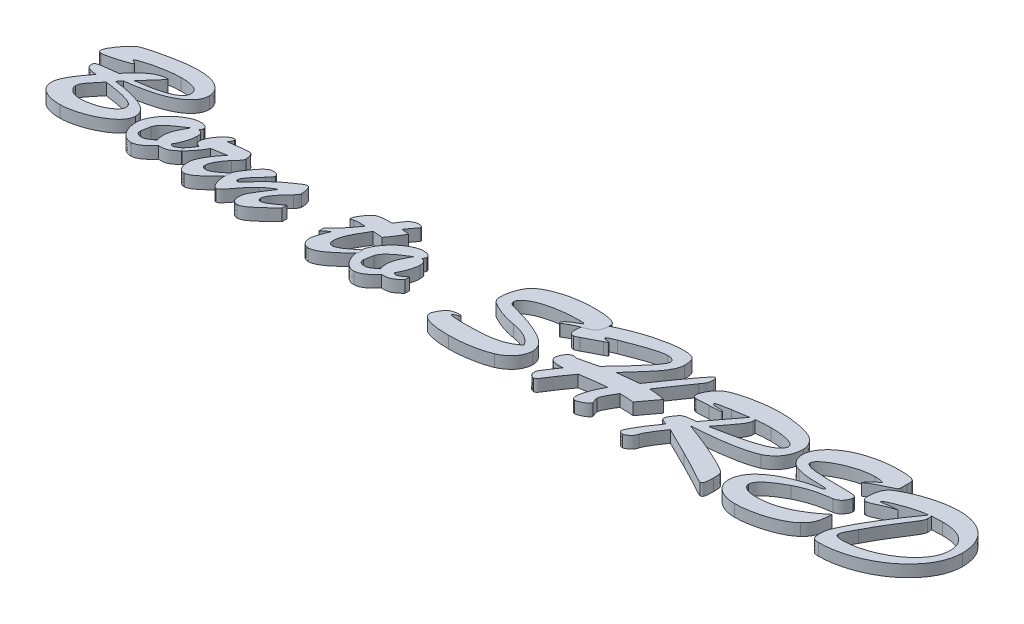
from build123d import *

# Parameters (mm, degrees)
BOSS_EXTRUDE1_DEPTH    = 2.54
BOSS_EXTRUDE1_2_DEPTH  = 2.54
BOSS_EXTRUDE1_3_DEPTH  = 2.54
BOSS_EXTRUDE1_4_DEPTH  = 2.54
BOSS_EXTRUDE1_5_DEPTH  = 2.54
BOSS_EXTRUDE1_6_DEPTH  = 2.54
BOSS_EXTRUDE1_7_DEPTH  = 2.54
BOSS_EXTRUDE1_8_DEPTH  = 2.54
BOSS_EXTRUDE1_9_DEPTH  = 2.54
BOSS_EXTRUDE1_10_DEPTH = 2.54
BOSS_EXTRUDE1_11_DEPTH = 2.54


with BuildPart() as part:
    # Sketch1 → Boss-Extrude1 (new body)
    with BuildSketch(Plane(origin=(0, 0, 0), x_dir=(1, 0, 0), z_dir=(0, 1, 0))):
        with BuildLine():
            Line((8.664676819, 10.585055881), (7.874472995, 9.629460558))
            add(Edge.make_bspline(
                [(7.874472995, 9.629460558), (8.098204445, 9.607800758), (8.535594369, 9.565456339), (9.171033382, 9.481774777), (9.770110779, 9.390630581), (10.506528627, 9.256969164), (11.367103972, 9.073868049), (12.326243931, 8.819247863), (13.193953254, 8.563820618), (13.72566805, 8.354279567), (13.975581593, 8.255792282)],
                knots=[0, 0, 0, 0, 0.859714041, 1.680721506, 2.451170941, 3.177326665, 4.543357982, 5.814947007, 6.972993905, 8, 8, 8, 8], degree=3))
            add(Edge.make_bspline(
                [(13.975581593, 8.255792282), (14.172074168, 8.169489303), (14.54784761, 8.004443029), (15.055398012, 7.703913517), (15.48921454, 7.381337289), (15.848792751, 7.033027974), (16.124822703, 6.651218766), (16.319516694, 6.244924273), (16.44813513, 5.814849048), (16.459752332, 5.517033576), (16.465642482, 5.366035273)],
                knots=[0, 0, 0, 0, 1.267361107, 2.423708094, 3.47716118, 4.456306804, 5.370563359, 6.24488698, 7.11012317, 8, 8, 8, 8], degree=3))
            add(Edge.make_bspline(
                [(16.465642482, 5.366035273), (16.452795335, 5.177631343), (16.426548516, 4.792720695), (16.218327076, 4.224530517), (15.883258366, 3.669764711), (15.429129714, 3.128695423), (14.878944395, 2.603971047), (14.240680488, 2.1103802), (13.530045378, 1.639883178), (12.752419843, 1.206769085), (11.931732233, 0.811401602), (11.088993365, 0.45808046), (10.236461233, 0.143988148), (9.378727887, -0.116004781), (8.536026841, -0.319709548), (7.725879775, -0.476309138), (6.953032208, -0.565405128), (6.450466158, -0.580661131), (6.206775389, -0.58805866)],
                knots=[0, 0, 0, 0, 0.712564817, 1.455775292, 2.264839529, 3.1593648, 4.123803986, 5.140636607, 6.212472301, 7.35039145, 8.510464522, 9.662513643, 10.811665701, 11.951595153, 13.056380002, 14.095436893, 15.076490644, 16, 16, 16, 16], degree=3))
            add(Edge.make_bspline(
                [(6.206775389, -0.58805866), (6.013710607, -0.585800258), (5.639365361, -0.581421302), (5.093901713, -0.536506952), (4.580216803, -0.477999843), (4.101144125, -0.377498422), (3.652068431, -0.262479469), (3.23905407, -0.107974821), (2.854436946, 0.064646947), (2.505973011, 0.267476486), (2.19119554, 0.489427593), (1.923753768, 0.742034266), (1.690030263, 1.008493042), (1.501426186, 1.297882845), (1.357428359, 1.607975489), (1.249702238, 1.934195597), (1.190955044, 2.284304527), (1.181147694, 2.523550304), (1.17611732, 2.64626397)],
                knots=[0, 0, 0, 0, 1.383710309, 2.682961499, 3.922146879, 5.086977825, 6.189505547, 7.241917307, 8.244112367, 9.208241214, 10.128425328, 10.99844964, 11.839164159, 12.664395647, 13.464939076, 14.284307388, 15.119988935, 16, 16, 16, 16], degree=3))
            add(Edge.make_bspline(
                [(1.17611732, 2.64626397), (1.186561623, 2.835582567), (1.208698163, 3.236840429), (1.380942285, 3.853940433), (1.634005031, 4.51995893), (1.930773082, 5.095356091), (2.220065374, 5.584055843), (2.465547569, 5.987076606), (2.743320631, 6.410080814), (3.046698391, 6.855693235), (3.376433464, 7.323643527), (3.737633145, 7.812838932), (4.125719884, 8.323904821), (4.396278158, 8.67109497), (4.534483574, 8.848445151)],
                knots=[0, 0, 0, 0, 0.951263667, 2.016188748, 3.203592303, 4.533354919, 5.265271798, 6.060596717, 6.90667715, 7.810439189, 8.772186954, 9.785958112, 10.86903263, 12, 12, 12, 12], degree=3))
            add(Edge.make_bspline(
                [(4.534483574, 8.848445151), (4.333473571, 8.859926858), (3.961927825, 8.881149581), (3.4549531, 8.964618126), (3.039224172, 9.069268003), (2.712037277, 9.210285332), (2.463298876, 9.389121485), (2.294255358, 9.607284569), (2.183689478, 9.85559518), (2.173626138, 10.034106173), (2.168466309, 10.125635053)],
                knots=[0, 0, 0, 0, 1.620598631, 2.995505281, 4.132544123, 5.065618832, 5.850134739, 6.570656336, 7.267125107, 8, 8, 8, 8], degree=3))
            add(Edge.make_bspline(
                [(2.168466309, 10.125635053), (2.175279028, 10.234153792), (2.187933031, 10.435717432), (2.360688409, 10.690859651), (2.616757868, 10.84952651), (2.880328849, 10.939539809), (3.155281537, 10.995938339), (3.446665381, 11.044682366), (3.817299579, 11.100012776), (4.264608651, 11.159041483), (4.787667724, 11.219673467), (5.380537916, 11.303674443), (6.044999235, 11.375333366), (6.510104936, 11.435604892), (6.753486174, 11.467143871)],
                knots=[0, 0, 0, 0, 0.757676578, 1.407315001, 2.087028647, 2.858775201, 3.369244765, 4.073429773, 4.950645925, 6.02265614, 7.268146286, 8.67910223, 10.262235425, 12, 12, 12, 12], degree=3))
            add(Edge.make_bspline(
                [(6.753486174, 11.467143871), (7.024635402, 11.785261392), (7.541058946, 12.391139487), (8.322824661, 13.213209878), (9.055341052, 13.916908076), (9.756675582, 14.500015373), (10.45251127, 14.970235681), (11.16800174, 15.320117061), (11.907705378, 15.570696643), (12.416416413, 15.640519665), (12.670826441, 15.675438657)],
                knots=[0, 0, 0, 0, 1.346005217, 2.56356542, 3.652039199, 4.615727429, 5.498043554, 6.349477723, 7.174562001, 8, 8, 8, 8], degree=3))
            add(Edge.make_bspline(
                [(12.670826441, 15.675438657), (12.714079708, 15.680908912), (12.804972766, 15.692404188), (12.926245883, 15.692248329), (13.052883746, 15.698533858), (13.078878291, 15.638758014), (13.088899395, 15.61571395)],
                knots=[0, 0, 0, 0, 1.140417194, 2.39648967, 3.381833987, 4, 4, 4, 4], degree=3))
            add(Edge.make_bspline(
                [(13.088899395, 15.61571395), (13.082266947, 15.592266094), (13.064695986, 15.530147043), (12.988173141, 15.428335629), (12.883527651, 15.283597615), (12.723990073, 15.101529055), (12.520122891, 14.869204234), (12.262286946, 14.581506715), (11.955199822, 14.229021168), (11.589410611, 13.827087827), (11.184180755, 13.368838038), (10.739428776, 12.870174531), (10.259084955, 12.329129872), (9.926597322, 11.955621662), (9.753504182, 11.761173201)],
                knots=[0, 0, 0, 0, 0.170753535, 0.45236748, 0.884343552, 1.43606511, 2.155340943, 3.06563507, 4.159790895, 5.45215942, 6.897868204, 8.473618983, 10.16416522, 12, 12, 12, 12], degree=3))
            add(Edge.make_bspline(
                [(9.753504182, 11.761173201), (10.216285939, 11.82654048), (11.097379811, 11.950993762), (12.35152726, 12.160091034), (13.471805711, 12.388313168), (14.465628512, 12.631042181), (15.33979722, 12.888141092), (16.094495247, 13.177759088), (16.741626186, 13.481925075), (17.274885607, 13.815361521), (17.697373752, 14.172413567), (18.002325464, 14.553901508), (18.193320073, 14.962309702), (18.217788473, 15.246352651), (18.229818462, 15.386003535)],
                knots=[0, 0, 0, 0, 1.724846668, 3.283949303, 4.691630375, 5.943130907, 7.058831284, 8.051754163, 8.923845706, 9.693686913, 10.366790242, 10.954680153, 11.486064197, 12, 12, 12, 12], degree=3))
            add(Edge.make_bspline(
                [(18.229818462, 15.386003535), (18.228074845, 15.469002486), (18.224649206, 15.632068468), (18.171398127, 15.865263485), (18.092814686, 16.082402633), (17.982032011, 16.281740782), (17.837203994, 16.461035038), (17.664700784, 16.62626965), (17.456251285, 16.766195659), (17.218399764, 16.890569515), (16.950202207, 17.002783733), (16.645156657, 17.089805451), (16.31069546, 17.175514827), (15.941580001, 17.236839353), (15.540078986, 17.287413161), (15.104857424, 17.324752766), (14.635722669, 17.3402287), (14.312494536, 17.34517567), (14.145567299, 17.347730472)],
                knots=[0, 0, 0, 0, 0.786734665, 1.545678105, 2.259061328, 2.97540466, 3.700117973, 4.44100218, 5.235898072, 6.075333835, 6.988423574, 7.991620688, 9.085337389, 10.266761078, 11.542402229, 12.929232788, 14.414139638, 16, 16, 16, 16], degree=3))
            add(Edge.make_bspline(
                [(14.145567299, 17.347730472), (13.947927777, 17.345266968), (13.53836285, 17.340161892), (12.902565371, 17.289483084), (12.225290377, 17.216944319), (11.519345004, 17.116158675), (10.811078984, 16.996182037), (10.121900684, 16.876654927), (9.470513043, 16.735931378), (8.666943675, 16.551926731), (7.745767179, 16.305433585), (6.899424553, 16.039630066), (6.333461527, 15.8266369), (6.043368873, 15.698992512), (5.847611507, 15.599833303), (5.793203364, 15.50855969), (5.77491981, 15.477887701)],
                knots=[0, 0, 0, 0, 0.95815754, 1.985573115, 3.090960949, 4.260812328, 5.442504965, 6.574240779, 7.651946592, 8.673252712, 10.571717014, 12.271896923, 12.979355426, 13.491289114, 13.829050538, 14, 14, 14, 14], degree=3))
            add(Edge.make_bspline(
                [(5.77491981, 15.477887701), (5.781300207, 15.461412862), (5.798448173, 15.417135056), (5.843259934, 15.398011573), (5.871398184, 15.386003535)],
                knots=[0, 0, 0, 0, 0.744157845, 2, 2, 2, 2], degree=3))
            add(Edge.make_bspline(
                [(5.871398184, 15.386003535), (5.982979179, 15.343419987), (6.178133955, 15.268941506), (6.4140341, 15.151345339), (6.581914093, 15.051885493), (6.616546612, 14.960581222), (6.629442551, 14.926582707)],
                knots=[0, 0, 0, 0, 1.566337202, 2.739518381, 3.530640762, 4, 4, 4, 4], degree=3))
            add(Edge.make_bspline(
                [(6.629442551, 14.926582707), (6.618771419, 14.902314872), (6.589268878, 14.835221447), (6.46034743, 14.761956238), (6.279686942, 14.664624805), (6.017889509, 14.558363722), (5.690768767, 14.428455805), (5.28555732, 14.293346203), (4.811008814, 14.134904457), (4.277240071, 13.980056107), (3.735836881, 13.815812971), (3.218484512, 13.683595248), (2.755796614, 13.552652756), (2.335896007, 13.460539077), (1.965290383, 13.376071626), (1.638782898, 13.331841562), (1.364136383, 13.286556741), (1.196165276, 13.283309502), (1.120986821, 13.281856142)],
                knots=[0, 0, 0, 0, 0.215306707, 0.595259719, 1.167436381, 1.939072629, 2.917487498, 4.083020845, 5.468793512, 7.055523875, 8.678683854, 10.147180263, 11.47127396, 12.654088564, 13.702312139, 14.612262365, 15.378893352, 16, 16, 16, 16], degree=3))
            add(Edge.make_bspline(
                [(1.120986821, 13.281856142), (1.035214417, 13.287085585), (0.879568022, 13.296575163), (0.675447512, 13.411235818), (0.556600862, 13.612118532), (0.54721872, 13.767201589), (0.542116577, 13.851537969)],
                knots=[0, 0, 0, 0, 1.104736656, 2.004703978, 2.914929535, 4, 4, 4, 4], degree=3))
            add(Edge.make_bspline(
                [(0.542116577, 13.851537969), (0.546143091, 13.913144188), (0.555150651, 14.050961102), (0.622200793, 14.270303837), (0.719322542, 14.525433594), (0.858660507, 14.813768425), (1.039403456, 15.134101829), (1.257379399, 15.488373164), (1.508839669, 15.87938511), (1.795740324, 16.288667952), (2.095259979, 16.697863507), (2.396603942, 17.079790145), (2.696648921, 17.419353034), (2.984408703, 17.723152008), (3.264394862, 17.988483108), (3.541819282, 18.207597972), (3.806579448, 18.397322961), (3.991163865, 18.492162592), (4.079656954, 18.537630417)],
                knots=[0, 0, 0, 0, 0.492233188, 1.101156038, 1.822038554, 2.676455987, 3.657642451, 4.762252669, 6.001939952, 7.374227217, 8.757939073, 10.056403163, 11.262434148, 12.379663494, 13.401935816, 14.342792312, 15.20550483, 16, 16, 16, 16], degree=3))
            add(Edge.make_bspline(
                [(4.079656954, 18.537630417), (4.158995696, 18.570562975), (4.355107906, 18.651966798), (4.713396827, 18.771511427), (5.189433771, 18.919579738), (6.003921613, 19.147764201), (7.157676581, 19.45710185), (8.644644041, 19.794182603), (10.206137277, 20.105759942), (11.531800926, 20.31901289), (12.577643188, 20.455486991), (13.317477568, 20.529914081), (14.011808119, 20.573187839), (14.457919278, 20.579161157), (14.673901252, 20.582053102)],
                knots=[0, 0, 0, 0, 0.285515603, 0.705747212, 1.254864839, 1.943005008, 3.51750929, 5.225556965, 7.010816859, 8.810371585, 9.688141018, 10.516927118, 11.281979385, 12, 12, 12, 12], degree=3))
            add(Edge.make_bspline(
                [(14.673901252, 20.582053102), (14.91293692, 20.58061986), (15.374750402, 20.577850858), (16.044307917, 20.522333974), (16.668556613, 20.45103747), (17.245660271, 20.331406073), (17.780111708, 20.195874638), (18.264603509, 20.011396734), (18.709440618, 19.810414585), (19.100344395, 19.563570658), (19.444884943, 19.295514999), (19.750575435, 19.018090394), (20.007771282, 18.718547565), (20.22000578, 18.403476311), (20.382047405, 18.068753681), (20.498383956, 17.719999463), (20.569441597, 17.353676286), (20.577802596, 17.10302431), (20.582053102, 16.975599601)],
                knots=[0, 0, 0, 0, 1.486941531, 2.872749697, 4.178904351, 5.393734845, 6.537999416, 7.605434921, 8.61583059, 9.570440747, 10.473975148, 11.330448872, 12.134640403, 12.924934093, 13.687863119, 14.441269008, 15.207583172, 16, 16, 16, 16], degree=3))
            add(Edge.make_bspline(
                [(20.582053102, 16.975599601), (20.574497166, 16.801715398), (20.559310691, 16.452230159), (20.421594044, 15.936652581), (20.208894347, 15.429748298), (19.903751652, 14.93549259), (19.515915015, 14.450167609), (19.028843103, 13.98470623), (18.451852481, 13.529809079), (17.77756993, 13.090862556), (17.00747273, 12.663263688), (16.122114378, 12.279480504), (15.136576929, 11.905573889), (14.040059383, 11.569483167), (12.843382407, 11.261354935), (11.540495129, 10.999072782), (10.139130289, 10.76208522), (9.166028235, 10.645250327), (8.664676819, 10.585055881)],
                knots=[0, 0, 0, 0, 0.573790395, 1.153246073, 1.752097641, 2.385809204, 3.066442096, 3.800257919, 4.607382793, 5.491845115, 6.456944054, 7.515154979, 8.678105096, 9.93969276, 11.303647403, 12.760942623, 14.33120689, 16, 16, 16, 16], degree=3))
        make_face()
        with BuildLine():
            add(Edge.make_bspline(
                [(7.019950254, 8.526850571), (6.887898964, 8.367872411), (6.632059799, 8.05986452), (6.265204818, 7.606561013), (5.915541742, 7.185548783), (5.591538486, 6.792749648), (5.298373606, 6.43687431), (5.053438287, 6.109741704), (4.845071942, 5.825487425), (4.640776815, 5.496659481), (4.452629162, 5.101680919), (4.424239944, 4.769475761), (4.41043995, 4.607990907)],
                knots=[0, 0, 0, 0, 1.297580472, 2.513961818, 3.661350271, 4.733642842, 5.71122381, 6.555441607, 7.299854436, 7.921575475, 8.989678291, 10, 10, 10, 10], degree=3))
            add(Edge.make_bspline(
                [(4.41043995, 4.607990907), (4.418566146, 4.482400753), (4.434994742, 4.228497207), (4.595840935, 3.867095022), (4.841642019, 3.529725728), (5.181183458, 3.222826528), (5.61003585, 2.956644955), (6.135070376, 2.78111567), (6.735858904, 2.661707886), (7.164742801, 2.651614283), (7.392081125, 2.64626397)],
                knots=[0, 0, 0, 0, 0.758747806, 1.533947953, 2.359626846, 3.280795701, 4.29485818, 5.400498468, 6.622083211, 8, 8, 8, 8], degree=3))
            add(Edge.make_bspline(
                [(7.392081125, 2.64626397), (7.619012481, 2.653049084), (8.082273452, 2.666900315), (8.785822255, 2.763382358), (9.510110611, 2.916470274), (10.242644515, 3.12449335), (10.957800956, 3.382716515), (11.628760575, 3.676643271), (12.23592815, 4.016555309), (12.775112271, 4.378545621), (13.227033355, 4.761364273), (13.562081239, 5.155661203), (13.777760252, 5.562383254), (13.805946434, 5.843228596), (13.819378511, 5.977064975)],
                knots=[0, 0, 0, 0, 1.06016049, 2.164227044, 3.312148238, 4.517122552, 5.718969904, 6.862489535, 7.935538164, 8.965545957, 9.893772176, 10.691734697, 11.376548354, 12, 12, 12, 12], degree=3))
            add(Edge.make_bspline(
                [(13.819378511, 5.977064975), (13.811043838, 6.087427427), (13.794338093, 6.30863429), (13.638864439, 6.619394449), (13.387888453, 6.891125064), (13.04271571, 7.128270114), (12.605247474, 7.341579539), (12.07583425, 7.548443659), (11.443637983, 7.730613028), (10.719927495, 7.908264367), (9.907417668, 8.076400067), (9.014045557, 8.235566705), (8.042597974, 8.386530971), (7.369263267, 8.478920613), (7.019950254, 8.526850571)],
                knots=[0, 0, 0, 0, 0.516012619, 1.034278689, 1.594886709, 2.239910011, 2.989823973, 3.878557251, 4.907717911, 6.078932596, 7.380291583, 8.806084166, 10.343058292, 12, 12, 12, 12], degree=3))
        make_face(mode=Mode.SUBTRACT)
    extrude(amount=BOSS_EXTRUDE1_DEPTH)


with BuildPart() as body_2:
    # Sketch1 → Boss-Extrude1 2 (new body)
    with BuildSketch(Plane(origin=(0, 0, 0), x_dir=(1, 0, 0), z_dir=(0, 1, 0))):
        with BuildLine():
            Line((27.827119562, 4.851483945), (27.827119562, 3.826975499))
            add(Edge.make_bspline(
                [(27.827119562, 3.826975499), (27.663123335, 3.684424995), (27.357394161, 3.418675908), (26.912508593, 3.073595006), (26.519755259, 2.802811234), (26.162197077, 2.593225275), (25.786477541, 2.455789768), (25.361678112, 2.378999988), (24.870723666, 2.336069841), (24.520885655, 2.349639081), (24.335521268, 2.356828849)],
                knots=[0, 0, 0, 0, 1.326692709, 2.473280475, 3.435551712, 4.239379219, 4.996773376, 5.864225407, 6.868343249, 8, 8, 8, 8], degree=3))
            add(Edge.make_bspline(
                [(24.335521268, 2.356828849), (24.172094416, 2.171252126), (23.85978247, 1.816611339), (23.379468622, 1.334870978), (22.914561133, 0.925707889), (22.462207549, 0.590231435), (22.025345457, 0.330081634), (21.602572128, 0.14113188), (21.191746798, 0.023641667), (20.919634996, 0.00767664), (20.788792475, 0)],
                knots=[0, 0, 0, 0, 1.355624993, 2.590626168, 3.727313514, 4.748426394, 5.67441081, 6.509089803, 7.283109197, 8, 8, 8, 8], degree=3))
            add(Edge.make_bspline(
                [(20.788792475, 0), (20.647282909, 0.0074469), (20.364912412, 0.022306566), (19.95176363, 0.130864778), (19.55891875, 0.314008151), (19.193728713, 0.570077021), (18.851689881, 0.880847139), (18.554548966, 1.256833109), (18.280718242, 1.67360269), (18.052035012, 2.144690744), (17.870832312, 2.656646273), (17.736565629, 3.201116081), (17.6581185, 3.774156206), (17.647283134, 4.165175599), (17.641759802, 4.364497868)],
                knots=[0, 0, 0, 0, 0.855509558, 1.707097737, 2.565061559, 3.464438916, 4.395465232, 5.350382483, 6.355095104, 7.407452959, 8.509213956, 9.63490185, 10.794390414, 12, 12, 12, 12], degree=3))
            add(Edge.make_bspline(
                [(17.641759802, 4.364497868), (17.650439409, 4.53513651), (17.668553486, 4.891254176), (17.801128368, 5.434717261), (18.011061926, 6.003851388), (18.301715262, 6.588411066), (18.650528679, 7.179010866), (19.05793836, 7.755172145), (19.512805927, 8.310505054), (20.012223659, 8.840995037), (20.542342534, 9.336317036), (21.098400649, 9.785745174), (21.669989416, 10.18532949), (22.257032769, 10.528930867), (22.838778178, 10.813004987), (23.40923231, 11.019794006), (23.959398438, 11.145939329), (24.321150429, 11.164248732), (24.496318558, 11.173114541)],
                knots=[0, 0, 0, 0, 0.791499778, 1.651836002, 2.582703007, 3.603040698, 4.676902459, 5.76339062, 6.874542189, 8.005854543, 9.142356788, 10.239025647, 11.321438051, 12.375837303, 13.393076106, 14.321525165, 15.187246224, 16, 16, 16, 16], degree=3))
            add(Edge.make_bspline(
                [(24.496318558, 11.173114541), (24.612805676, 11.170645038), (24.83282711, 11.16598063), (25.143469164, 11.127098744), (25.413742903, 11.053058813), (25.643988794, 10.954125508), (25.832559224, 10.830952797), (25.972681667, 10.681554943), (26.056422472, 10.502261488), (26.06682427, 10.374563755), (26.072131999, 10.309403384)],
                knots=[0, 0, 0, 0, 1.405108728, 2.653976187, 3.76548404, 4.774638535, 5.666182971, 6.46398965, 7.216219413, 8, 8, 8, 8], degree=3))
            add(Edge.make_bspline(
                [(26.072131999, 10.309403384), (26.067088497, 10.255192343), (26.056217185, 10.138339981), (25.979112168, 9.961760754), (25.864079526, 9.772594879), (25.760239981, 9.652479228), (25.704595336, 9.588112684)],
                knots=[0, 0, 0, 0, 0.787103102, 1.696607463, 2.765677774, 4, 4, 4, 4], degree=3))
            add(Edge.make_bspline(
                [(25.704595336, 9.588112684), (25.798693658, 9.56597229), (25.973145163, 9.524925595), (26.2080996, 9.433136684), (26.397011268, 9.320078648), (26.540945995, 9.173521757), (26.640519147, 8.983710022), (26.712739627, 8.745990235), (26.749984374, 8.44834685), (26.75431421, 8.231374352), (26.756669033, 8.113371826)],
                knots=[0, 0, 0, 0, 1.135342827, 2.104843743, 2.954052047, 3.705239993, 4.486876621, 5.449163014, 6.612703401, 8, 8, 8, 8], degree=3))
            add(Edge.make_bspline(
                [(26.756669033, 8.113371826), (26.75121273, 7.979967982), (26.739558075, 7.695017577), (26.67268215, 7.242636056), (26.552733341, 6.742731729), (26.402036068, 6.201282886), (26.207102173, 5.647962675), (25.980170122, 5.099741227), (25.721870769, 4.568729547), (25.52016756, 4.229938949), (25.419754423, 4.061280121)],
                knots=[0, 0, 0, 0, 0.743119266, 1.587301605, 2.540937163, 3.604522133, 4.715656266, 5.805212925, 6.907377541, 8, 8, 8, 8], degree=3))
            Line((25.419754423, 4.061280121), (25.704595336, 3.781033416))
            Line((25.704595336, 3.781033416), (25.938899959, 3.781033416))
            add(Edge.make_bspline(
                [(25.938899959, 3.781033416), (26.028622901, 3.787279945), (26.211638734, 3.800021543), (26.471182207, 3.903647518), (26.705831056, 4.041919479), (26.901944567, 4.170504575), (27.082087215, 4.302215682), (27.27450935, 4.447432937), (27.532784963, 4.632354924), (27.721721779, 4.773016401), (27.827119562, 4.851483945)],
                knots=[0, 0, 0, 0, 0.974523146, 1.987821175, 3.003724616, 3.942915018, 4.54018134, 5.434293142, 6.568728837, 8, 8, 8, 8], degree=3))
        make_face()
        with BuildLine():
            add(Edge.make_bspline(
                [(24.574420099, 9.114909231), (24.371566258, 8.987357995), (23.978849324, 8.740423896), (23.421123571, 8.364761767), (22.899592517, 8.020391047), (22.290218687, 7.581641282), (21.607060564, 7.057304377), (21.009085931, 6.501565492), (20.615677932, 6.048979343), (20.377091966, 5.717788854), (20.195590905, 5.379832541), (20.109447802, 5.148093804), (20.067501775, 5.035252277)],
                knots=[0, 0, 0, 0, 1.162679127, 2.250900356, 3.262870239, 4.194964729, 5.894092788, 7.439515267, 8.145588819, 8.801256047, 9.416290514, 10, 10, 10, 10], degree=3))
            add(Edge.make_bspline(
                [(20.067501775, 5.035252277), (20.03786526, 4.896003499), (19.981906882, 4.63308001), (19.911593066, 4.263063554), (19.844261286, 3.945420279), (19.795990586, 3.678239632), (19.752427717, 3.464486769), (19.726497954, 3.300149592), (19.704848047, 3.188888999), (19.701203869, 3.130221669), (19.699965112, 3.110279007)],
                knots=[0, 0, 0, 0, 1.742956137, 3.290974022, 4.611019174, 5.717848655, 6.615064775, 7.280854166, 7.755542263, 8, 8, 8, 8], degree=3))
            add(Edge.make_bspline(
                [(19.699965112, 3.110279007), (19.703972689, 3.027035431), (19.711533537, 2.869984927), (19.779047801, 2.650596617), (19.884112515, 2.462275271), (20.038803469, 2.309079783), (20.237186757, 2.195163981), (20.475292712, 2.112019918), (20.756699331, 2.069563692), (20.957124941, 2.062166315), (21.064444972, 2.05820531)],
                knots=[0, 0, 0, 0, 1.014581525, 1.914148187, 2.777379664, 3.62403064, 4.538454421, 5.550272354, 6.688267212, 8, 8, 8, 8], degree=3))
            add(Edge.make_bspline(
                [(21.064444972, 2.05820531), (21.122996121, 2.062258894), (21.249956177, 2.071048529), (21.451107744, 2.133774234), (21.679072945, 2.224417566), (21.932452989, 2.356836531), (22.214203145, 2.522231307), (22.51871408, 2.731535754), (22.856032668, 2.969474865), (23.08503758, 3.146117221), (23.205346031, 3.238916839)],
                knots=[0, 0, 0, 0, 0.567343837, 1.230206509, 2.029799379, 2.946178952, 3.997879171, 5.19625707, 6.527044828, 8, 8, 8, 8], degree=3))
            add(Edge.make_bspline(
                [(23.205346031, 3.238916839), (23.163113534, 3.362267438), (23.080657076, 3.603102204), (23.000155383, 3.968355891), (22.94623209, 4.323084968), (22.938222475, 4.557267402), (22.934287742, 4.672309823)],
                knots=[0, 0, 0, 0, 1.066770372, 2.082806203, 3.058176096, 4, 4, 4, 4], degree=3))
            add(Edge.make_bspline(
                [(22.934287742, 4.672309823), (22.939904218, 4.841072161), (22.951195411, 5.180346863), (23.034257327, 5.690796013), (23.162211431, 6.206031404), (23.346931429, 6.731269633), (23.579459207, 7.278671791), (23.869053038, 7.855925738), (24.197165915, 8.477324149), (24.445459931, 8.896957828), (24.574420099, 9.114909231)],
                knots=[0, 0, 0, 0, 0.844663825, 1.698086618, 2.583260525, 3.499823322, 4.482443276, 5.559155309, 6.732262081, 8, 8, 8, 8], degree=3))
        make_face(mode=Mode.SUBTRACT)
    extrude(amount=BOSS_EXTRUDE1_2_DEPTH)


with BuildPart() as body_3:
    # Sketch1 → Boss-Extrude1 3 (new body)
    with BuildSketch(Plane(origin=(0, 0, 0), x_dir=(1, 0, 0), z_dir=(0, 1, 0))):
        with BuildLine():
            Line((27.556061274, 3.638612959), (27.556061274, 4.736628738))
            add(Edge.make_bspline(
                [(27.556061274, 4.736628738), (27.689006962, 4.904136157), (27.941168218, 5.221851473), (28.281654785, 5.689577632), (28.577507187, 6.11344817), (28.748587177, 6.389828515), (28.828656968, 6.519181552)],
                knots=[0, 0, 0, 0, 1.170756816, 2.220602377, 3.167196615, 4, 4, 4, 4], degree=3))
            add(Edge.make_bspline(
                [(28.828656968, 6.519181552), (28.751702175, 6.548819709), (28.606363397, 6.604795088), (28.405063092, 6.699681797), (28.239387961, 6.809340038), (28.104006501, 6.9309454), (28.001788347, 7.078243451), (27.930150518, 7.251820425), (27.888507393, 7.457551734), (27.884438, 7.603204805), (27.882250062, 7.681516247)],
                knots=[0, 0, 0, 0, 1.209969933, 2.285179997, 3.2573193, 4.115842444, 4.93863427, 5.865037457, 6.852121733, 8, 8, 8, 8], degree=3))
            add(Edge.make_bspline(
                [(27.882250062, 7.681516247), (27.887948907, 7.781595748), (27.900148777, 7.995842129), (27.997829599, 8.331601086), (28.145465361, 8.701317575), (28.420641844, 9.245576277), (28.858608557, 9.924033464), (29.371964125, 10.557886442), (29.811065181, 11.007917259), (30.130024593, 11.282299175), (30.432273914, 11.496917028), (30.641821844, 11.592442912), (30.739847613, 11.637129578)],
                knots=[0, 0, 0, 0, 0.594697849, 1.273106498, 2.066554359, 2.962905714, 4.896321801, 6.858459045, 7.805465603, 8.632563479, 9.360318103, 10, 10, 10, 10], degree=3))
            add(Edge.make_bspline(
                [(30.739847613, 11.637129578), (30.81221602, 11.66926494), (30.950071784, 11.730480118), (31.100326028, 11.741944505), (31.171703191, 11.747390576)],
                knots=[0, 0, 0, 0, 1.049914848, 2, 2, 2, 2], degree=3))
            add(Edge.make_bspline(
                [(31.171703191, 11.747390576), (31.219863887, 11.74497911), (31.306636848, 11.74063428), (31.420636243, 11.682957128), (31.487385883, 11.578077076), (31.491218578, 11.497223433), (31.493297771, 11.453361246)],
                knots=[0, 0, 0, 0, 1.152810748, 2.077063083, 2.956828464, 4, 4, 4, 4], degree=3))
            add(Edge.make_bspline(
                [(31.493297771, 11.453361246), (31.484551944, 11.39768494), (31.462963938, 11.260254774), (31.358562621, 11.029522558), (31.201689157, 10.732115091), (31.070428696, 10.513942582), (30.997123277, 10.392099133)],
                knots=[0, 0, 0, 0, 0.57154836, 1.410797375, 2.554000326, 4, 4, 4, 4], degree=3))
            add(Edge.make_bspline(
                [(30.997123277, 10.392099133), (31.255806604, 10.43125502), (31.748333451, 10.505806889), (32.450704276, 10.598363715), (33.07614078, 10.689239317), (33.627489482, 10.758576798), (34.104067653, 10.808399697), (34.505255777, 10.845826275), (34.829939268, 10.870749383), (35.021622443, 10.876572276), (35.104345481, 10.879085211)],
                knots=[0, 0, 0, 0, 1.517409458, 2.889111197, 4.108807755, 5.182954051, 6.111844727, 6.887847242, 7.520037924, 8, 8, 8, 8], degree=3))
            add(Edge.make_bspline(
                [(35.104345481, 10.879085211), (35.198610213, 10.880106848), (35.355017103, 10.881801978), (35.504410635, 10.83711509), (35.563766309, 10.819360503)],
                knots=[0, 0, 0, 0, 1.205378257, 2, 2, 2, 2], degree=3))
            add(Edge.make_bspline(
                [(35.563766309, 10.819360503), (35.606771774, 10.790632812), (35.699759005, 10.728517255), (35.813317876, 10.583969764), (35.913087884, 10.396337249), (36.030898262, 10.093380485), (36.142272451, 9.681138637), (36.15787989, 9.339296079), (36.165607594, 9.17003973)],
                knots=[0, 0, 0, 0, 0.510310252, 1.103402495, 1.796726408, 2.614600255, 4.323788586, 6, 6, 6, 6], degree=3))
            add(Edge.make_bspline(
                [(36.165607594, 9.17003973), (36.161448192, 9.11460581), (36.152856204, 9.000097151), (36.09931777, 8.82467104), (36.004323085, 8.647792409), (35.875340819, 8.456558587), (35.696111653, 8.249046169), (35.482642209, 7.993098675), (35.209611753, 7.701915267), (35.009662001, 7.494413288), (34.902200316, 7.382892709)],
                knots=[0, 0, 0, 0, 0.596607742, 1.232399805, 1.954314114, 2.749203525, 3.708776231, 4.900399092, 6.334139783, 8, 8, 8, 8], degree=3))
            add(Edge.make_bspline(
                [(34.902200316, 7.382892709), (34.766939648, 7.225263434), (34.497604328, 6.911387038), (34.13098409, 6.412984714), (33.793163205, 5.897117884), (33.498436936, 5.373139463), (33.254186503, 4.87324576), (33.078594512, 4.426367571), (32.960157788, 4.047282284), (32.940185776, 3.812264925), (32.931284963, 3.707526083)],
                knots=[0, 0, 0, 0, 1.1788436, 2.347350646, 3.509663661, 4.677556017, 5.75856454, 6.664295628, 7.404724272, 8, 8, 8, 8], degree=3))
            add(Edge.make_bspline(
                [(32.931284963, 3.707526083), (32.933711016, 3.647582396), (32.938318489, 3.533739476), (32.978900715, 3.37256486), (33.053472896, 3.237954592), (33.155596838, 3.126054248), (33.285638022, 3.038423268), (33.446095327, 2.978799151), (33.633151234, 2.949593439), (33.765813205, 2.943521497), (33.836343995, 2.9402933)],
                knots=[0, 0, 0, 0, 1.058970927, 2.011159953, 2.907848527, 3.751036084, 4.667132249, 5.652608723, 6.751990794, 8, 8, 8, 8], degree=3))
            add(Edge.make_bspline(
                [(33.836343995, 2.9402933), (33.924297271, 2.94763603), (34.118325185, 2.963834341), (34.422491049, 3.071913898), (34.770457322, 3.231128283), (35.163067967, 3.451445338), (35.596081477, 3.742918549), (36.077380516, 4.090178696), (36.599399946, 4.505102432), (36.956666251, 4.807584444), (37.144173958, 4.966339153)],
                knots=[0, 0, 0, 0, 0.537074028, 1.18480354, 1.954918745, 2.875993105, 3.929090292, 5.141296187, 6.49963742, 8, 8, 8, 8], degree=3))
            Line((37.144173958, 4.966339153), (37.144173958, 3.872917581))
            add(Edge.make_bspline(
                [(37.144173958, 3.872917581), (36.936268381, 3.656639871), (36.542247781, 3.246752485), (35.976023879, 2.668916579), (35.463093153, 2.166431443), (35.003884365, 1.726261125), (34.57924882, 1.347946672), (34.177867615, 1.015288406), (33.793301861, 0.720094879), (33.424703193, 0.468421837), (33.075400358, 0.261998968), (32.743924339, 0.11232302), (32.428137609, 0.0170803), (32.221282708, 0.005512656), (32.122704306, 0)],
                knots=[0, 0, 0, 0, 1.673728622, 3.172033995, 4.51326978, 5.679642986, 6.720511198, 7.685352113, 8.58760008, 9.424104508, 10.174401219, 10.8475722, 11.450801063, 12, 12, 12, 12], degree=3))
            add(Edge.make_bspline(
                [(32.122704306, 0), (32.015924472, 0.00638702), (31.804952229, 0.019006295), (31.504899246, 0.142241021), (31.239267813, 0.34272545), (31.001120779, 0.614094745), (30.810440856, 0.961897084), (30.673284862, 1.380478565), (30.592768074, 1.865236736), (30.583790244, 2.211022175), (30.579050323, 2.393582515)],
                knots=[0, 0, 0, 0, 0.804380352, 1.589269438, 2.409170875, 3.303542514, 4.298960831, 5.38656711, 6.620216058, 8, 8, 8, 8], degree=3))
            add(Edge.make_bspline(
                [(30.579050323, 2.393582515), (30.584279111, 2.511726803), (30.595211729, 2.758748929), (30.661920651, 3.139326158), (30.775024706, 3.543024526), (30.933410635, 3.968581568), (31.129750197, 4.419629199), (31.376726039, 4.885763272), (31.656279687, 5.374589223), (32.092620941, 6.054464232), (32.703208975, 6.91609135), (33.244318537, 7.578927076), (33.519343623, 7.915820869)],
                knots=[0, 0, 0, 0, 0.557581478, 1.165819901, 1.817972858, 2.533502653, 3.306830331, 4.137454648, 5.021198022, 5.963366097, 7.948334925, 10, 10, 10, 10], degree=3))
            add(Edge.make_bspline(
                [(33.519343623, 7.915820869), (33.363151957, 7.88513959), (33.031018721, 7.819897489), (32.509400573, 7.718615328), (31.942048188, 7.61994911), (31.454900648, 7.535161317), (31.074101541, 7.466263154), (30.818812998, 7.428041643), (30.600809739, 7.38418039), (30.465775967, 7.361176882), (30.404470408, 7.350733251)],
                knots=[0, 0, 0, 0, 1.206707352, 2.56599872, 4.028045479, 5.572138952, 6.314595984, 6.961605096, 7.528566979, 8, 8, 8, 8], degree=3))
            add(Edge.make_bspline(
                [(30.404470408, 7.350733251), (30.22941477, 7.014155729), (29.876400913, 6.335419927), (29.207765681, 5.384379253), (28.441102635, 4.471276477), (27.854439386, 3.919332685), (27.556061274, 3.638612959)],
                knots=[0, 0, 0, 0, 0.966144468, 1.948308485, 2.956505555, 4, 4, 4, 4], degree=3))
        make_face()
    extrude(amount=BOSS_EXTRUDE1_3_DEPTH)


with BuildPart() as body_4:
    # Sketch1 → Boss-Extrude1 4 (new body)
    with BuildSketch(Plane(origin=(0, 0, 0), x_dir=(1, 0, 0), z_dir=(0, 1, 0))):
        with BuildLine():
            add(Edge.make_bspline(
                [(47.862461879, 7.653950997), (47.635965055, 7.417880026), (47.207478505, 6.97128111), (46.621471136, 6.31889709), (46.127649992, 5.721175405), (45.721287719, 5.179655936), (45.398819396, 4.694565094), (45.171569574, 4.263155557), (45.022121801, 3.886959934), (44.997506175, 3.648759937), (44.986487495, 3.542134585)],
                knots=[0, 0, 0, 0, 1.542474231, 2.918051791, 4.133796869, 5.196673998, 6.10993081, 6.875349106, 7.496573053, 8, 8, 8, 8], degree=3))
            add(Edge.make_bspline(
                [(44.986487495, 3.542134585), (44.99175055, 3.445983017), (45.001193535, 3.273467645), (45.109705315, 3.046542669), (45.309273918, 2.912107427), (45.463764256, 2.900567325), (45.546980905, 2.894351217)],
                knots=[0, 0, 0, 0, 1.179704486, 2.116628596, 2.985516765, 4, 4, 4, 4], degree=3))
            add(Edge.make_bspline(
                [(45.546980905, 2.894351217), (45.63025391, 2.900356265), (45.812913796, 2.913528376), (46.099825256, 3.010832742), (46.419997122, 3.159281061), (46.709032251, 3.32687919), (46.96554989, 3.492340356), (47.19432778, 3.639322064), (47.443469404, 3.816056372), (47.726630672, 4.005753587), (48.026789078, 4.229693137), (48.359564348, 4.467344806), (48.716996155, 4.728421043), (48.96222069, 4.912455746), (49.08911549, 5.007687027)],
                knots=[0, 0, 0, 0, 0.718800202, 1.576692983, 2.594950298, 3.76822411, 4.458200875, 5.232449248, 6.116862398, 7.096664416, 8.176324706, 9.351312796, 10.629400471, 12, 12, 12, 12], degree=3))
            Line((49.08911549, 5.007687027), (49.08911549, 3.992366997))
            add(Edge.make_bspline(
                [(49.08911549, 3.992366997), (48.907274518, 3.815843485), (48.55443336, 3.473320239), (48.037297679, 2.984328781), (47.551787235, 2.532723428), (47.10435415, 2.114677644), (46.687096004, 1.736871451), (46.297958544, 1.403862603), (45.951788555, 1.096562352), (45.628466903, 0.834920777), (45.330671531, 0.605318468), (45.049498745, 0.406333217), (44.782590452, 0.236342634), (44.526454719, 0.102054717), (44.287307518, -0.004833125), (44.062275715, -0.084657464), (43.849312078, -0.134361606), (43.711061101, -0.139814185), (43.644978676, -0.142420457)],
                knots=[0, 0, 0, 0, 1.754502223, 3.404406538, 4.927156891, 6.345019316, 7.643715668, 8.823595089, 9.890773944, 10.847839706, 11.70240658, 12.493662949, 13.232009907, 13.891214988, 14.494041679, 15.04391894, 15.543003919, 16, 16, 16, 16], degree=3))
            add(Edge.make_bspline(
                [(43.644978676, -0.142420457), (43.54189332, -0.137104827), (43.348081979, -0.127110882), (43.075167831, -0.053262552), (42.842410471, 0.077611971), (42.65643572, 0.267822207), (42.510295718, 0.504649869), (42.412152319, 0.79328041), (42.346312377, 1.130268671), (42.342334862, 1.373300398), (42.340223524, 1.502306108)],
                knots=[0, 0, 0, 0, 1.031764595, 1.939826257, 2.805443797, 3.673097288, 4.575441275, 5.570054729, 6.710140356, 8, 8, 8, 8], degree=3))
            add(Edge.make_bspline(
                [(42.340223524, 1.502306108), (42.347606911, 1.664061994), (42.362468477, 1.989650472), (42.504830606, 2.472077684), (42.711320189, 2.956259706), (42.933611324, 3.37379597), (43.148824, 3.745489064), (43.359694569, 4.080525787), (43.599201297, 4.475999575), (43.885026279, 4.917592968), (44.198593268, 5.404801834), (44.537260638, 5.927875926), (44.903001784, 6.480409403), (45.152040293, 6.860578435), (45.280516825, 7.056703921)],
                knots=[0, 0, 0, 0, 0.91469094, 1.841125167, 2.82925679, 3.896872626, 4.519140102, 5.263456103, 6.140259144, 7.139459643, 8.244522674, 9.424170856, 10.671154939, 12, 12, 12, 12], degree=3))
            add(Edge.make_bspline(
                [(45.280516825, 7.056703921), (45.105639133, 6.972750899), (44.723365037, 6.789233693), (44.143627088, 6.412536685), (43.498994021, 5.93719099), (43.06099547, 5.570792401), (42.827209602, 5.37522369)],
                knots=[0, 0, 0, 0, 0.779511773, 1.703974684, 2.774474775, 4, 4, 4, 4], degree=3))
            add(Edge.make_bspline(
                [(42.827209602, 5.37522369), (42.68701026, 5.239774194), (42.413609269, 4.97563582), (42.02792219, 4.575351569), (41.672853739, 4.185596452), (41.238449064, 3.665610904), (40.694543114, 2.986476023), (40.164096231, 2.284881413), (39.745681178, 1.73358881), (39.465413701, 1.391310976), (39.236202142, 1.118440523), (39.04969941, 0.910639184), (38.882211359, 0.764103604), (38.720668134, 0.662157134), (38.556110658, 0.599064926), (38.443280483, 0.591624588), (38.389204402, 0.58805866)],
                knots=[0, 0, 0, 0, 1.239128748, 2.416409535, 3.532915475, 4.589904804, 6.722939757, 9.063311076, 10.180962302, 11.122082312, 11.874950628, 12.446664482, 12.895421843, 13.284453173, 13.657060106, 14, 14, 14, 14], degree=3))
            add(Edge.make_bspline(
                [(38.389204402, 0.58805866), (38.305087463, 0.602803523), (38.118401125, 0.635527781), (37.873906421, 0.860530178), (37.656375906, 1.196066905), (37.446868735, 1.640713252), (37.269907325, 2.167661504), (37.142336196, 2.7532528), (37.063372592, 3.379179282), (37.053019891, 3.811418073), (37.047695584, 4.033714871)],
                knots=[0, 0, 0, 0, 0.514439864, 1.141730723, 1.951305949, 2.971287881, 4.14055623, 5.351851093, 6.638079143, 8, 8, 8, 8], degree=3))
            add(Edge.make_bspline(
                [(37.047695584, 4.033714871), (37.050402495, 4.168566964), (37.055519901, 4.423504323), (37.091267564, 4.781627049), (37.149383749, 5.092787293), (37.236085744, 5.374824366), (37.371964113, 5.652092989), (37.544769619, 5.966187653), (37.758834775, 6.332123333), (37.924130944, 6.588755039), (38.012479323, 6.725920924)],
                knots=[0, 0, 0, 0, 1.108970449, 2.096504344, 2.956081418, 3.708919518, 4.514679981, 5.489685829, 6.658273864, 8, 8, 8, 8], degree=3))
            add(Edge.make_bspline(
                [(38.012479323, 6.725920924), (38.183059404, 6.983398437), (38.503041357, 7.466386581), (38.988959261, 8.118918124), (39.425852274, 8.671445409), (39.83703461, 9.114371609), (40.22485082, 9.461366662), (40.606833495, 9.705334649), (40.981601182, 9.867770664), (41.236238501, 9.886864626), (41.357062952, 9.895924639)],
                knots=[0, 0, 0, 0, 1.557908559, 2.92239644, 4.103704986, 5.109483974, 5.969322624, 6.719525534, 7.39241968, 8, 8, 8, 8], degree=3))
            add(Edge.make_bspline(
                [(41.357062952, 9.895924639), (41.508100962, 9.888433865), (41.785294183, 9.874686388), (42.106638341, 9.763204909), (42.296739509, 9.623341606), (42.398061292, 9.495907808), (42.455469932, 9.339872094), (42.461227785, 9.228715369), (42.464267148, 9.17003973)],
                knots=[0, 0, 0, 0, 1.825474338, 3.350210402, 4.024751285, 4.658611173, 5.291929068, 6, 6, 6, 6], degree=3))
            add(Edge.make_bspline(
                [(42.464267148, 9.17003973), (42.459680532, 9.114164387), (42.449890777, 8.994903058), (42.369991051, 8.826497754), (42.268664674, 8.663555976), (42.169151726, 8.5258461), (42.063933499, 8.406422705), (41.958940367, 8.277683577), (41.808954992, 8.126773423), (41.704018204, 8.008316944), (41.646498074, 7.943386119)],
                knots=[0, 0, 0, 0, 0.889146375, 1.897809894, 2.929933841, 3.962347669, 4.604490243, 5.472175411, 6.614396304, 8, 8, 8, 8], degree=3))
            add(Edge.make_bspline(
                [(41.646498074, 7.943386119), (41.44607437, 7.736374001), (41.067646691, 7.345506487), (40.553822072, 6.774881165), (40.116208821, 6.265515615), (39.754349669, 5.817173464), (39.474609639, 5.421629983), (39.276979291, 5.082686127), (39.140773762, 4.801300524), (39.11637009, 4.62422972), (39.105900894, 4.548266199)],
                knots=[0, 0, 0, 0, 1.612907786, 3.045393014, 4.297930401, 5.371712688, 6.270692234, 7.004422206, 7.5728963, 8, 8, 8, 8], degree=3))
            add(Edge.make_bspline(
                [(39.105900894, 4.548266199), (39.107703512, 4.484733154), (39.110896797, 4.372186189), (39.171423638, 4.226661172), (39.277916143, 4.129175647), (39.367428495, 4.120761396), (39.413712849, 4.11641062)],
                knots=[0, 0, 0, 0, 1.265114777, 2.2411145, 3.090529107, 4, 4, 4, 4], degree=3))
            add(Edge.make_bspline(
                [(39.413712849, 4.11641062), (39.454364383, 4.12674258), (39.560921298, 4.153824995), (39.727474176, 4.278059359), (39.93528287, 4.468359575), (40.191681654, 4.724866771), (40.481946538, 5.047885397), (40.831498471, 5.405039323), (41.20351043, 5.824068177), (41.626089685, 6.274517993), (42.082972744, 6.760956343), (42.589958426, 7.254456524), (43.132533952, 7.761269585), (43.715963681, 8.276661818), (44.341861545, 8.792458438), (45.008314466, 9.305739268), (45.722410697, 9.798915967), (46.215421591, 10.119177051), (46.465822561, 10.281838134)],
                knots=[0, 0, 0, 0, 0.212440549, 0.556854995, 1.038072984, 1.656551446, 2.402550011, 3.253244713, 4.20407774, 5.259512502, 6.402926644, 7.606801455, 8.866621693, 10.189007328, 11.575886513, 13.001965, 14.477293545, 16, 16, 16, 16], degree=3))
            add(Edge.make_bspline(
                [(46.465822561, 10.281838134), (46.59276398, 10.371831033), (46.827689899, 10.538377653), (47.17817838, 10.731116122), (47.499303794, 10.852969371), (47.706975013, 10.870843174), (47.802737171, 10.879085211)],
                knots=[0, 0, 0, 0, 1.255438111, 2.323394164, 3.22687701, 4, 4, 4, 4], degree=3))
            add(Edge.make_bspline(
                [(47.802737171, 10.879085211), (47.844505365, 10.866977788), (47.945684258, 10.837648875), (48.066096795, 10.683075739), (48.176210249, 10.455533614), (48.331205333, 10.04338601), (48.478544955, 9.461112327), (48.50279361, 8.975048622), (48.514839455, 8.733589944)],
                knots=[0, 0, 0, 0, 0.326747352, 0.791509812, 1.426315634, 2.280239498, 4.152158971, 6, 6, 6, 6], degree=3))
            add(Edge.make_bspline(
                [(48.514839455, 8.733589944), (48.50443487, 8.665155128), (48.48035384, 8.506765264), (48.343002123, 8.258820507), (48.135067288, 7.968206554), (47.959460427, 7.765769516), (47.862461879, 7.653950997)],
                knots=[0, 0, 0, 0, 0.644528135, 1.491736668, 2.614530764, 4, 4, 4, 4], degree=3))
        make_face()
    extrude(amount=BOSS_EXTRUDE1_4_DEPTH)


with BuildPart() as body_5:
    # Sketch1 → Boss-Extrude1 5 (new body)
    with BuildSketch(Plane(origin=(0, 0, 0), x_dir=(1, 0, 0), z_dir=(0, 1, 0))):
        with BuildLine():
            Line((62.991189751, 12.937290521), (63.657349951, 12.937290521))
            add(Edge.make_bspline(
                [(63.657349951, 12.937290521), (63.787417543, 13.165910456), (64.031585761, 13.595085172), (64.419822152, 14.166096338), (64.772515973, 14.643786579), (65.124484569, 15.012502164), (65.476197115, 15.29688544), (65.85152769, 15.494330792), (66.251898264, 15.614172294), (66.527930524, 15.627431761), (66.666556376, 15.634090783)],
                knots=[0, 0, 0, 0, 1.485435871, 2.788521137, 3.899550981, 4.835822124, 5.661490323, 6.443285944, 7.21820438, 8, 8, 8, 8], degree=3))
            add(Edge.make_bspline(
                [(66.666556376, 15.634090783), (66.79140278, 15.631270133), (67.008808356, 15.626358299), (67.28254471, 15.562635555), (67.480506562, 15.436813077), (67.504880418, 15.309020055), (67.516484908, 15.248177287)],
                knots=[0, 0, 0, 0, 1.45555115, 2.534674013, 3.302352451, 4, 4, 4, 4], degree=3))
            add(Edge.make_bspline(
                [(67.516484908, 15.248177287), (67.504463774, 15.203016716), (67.471326178, 15.078526573), (67.329017637, 14.87000636), (67.12089586, 14.578775226), (66.843874849, 14.228622848), (66.547339687, 13.858029812), (66.274244415, 13.496798855), (66.039618543, 13.171008453), (65.906019854, 12.957839325), (65.844193094, 12.859188981)],
                knots=[0, 0, 0, 0, 0.381456489, 1.051527273, 2.04166423, 3.330785377, 4.708095631, 5.936728231, 7.045159721, 8, 8, 8, 8], degree=3))
            add(Edge.make_bspline(
                [(65.844193094, 12.859188981), (66.009573174, 12.839183273), (66.320348887, 12.801589338), (66.753686255, 12.750629006), (67.115696767, 12.712721551), (67.331235187, 12.683489147), (67.424600742, 12.670826441)],
                knots=[0, 0, 0, 0, 1.255965557, 2.360160862, 3.289664958, 4, 4, 4, 4], degree=3))
            add(Edge.make_bspline(
                [(67.424600742, 12.670826441), (67.271560331, 12.388730209), (66.960019167, 11.81447281), (66.422514989, 10.969955615), (65.845183783, 10.105823524), (65.421161972, 9.540257453), (65.205598142, 9.252735479)],
                knots=[0, 0, 0, 0, 0.94374976, 1.92117165, 2.9431671, 4, 4, 4, 4], degree=3))
            add(Edge.make_bspline(
                [(65.205598142, 9.252735479), (65.0739398, 9.264017788), (64.832154609, 9.284737288), (64.491815216, 9.305854019), (64.182688618, 9.331721407), (63.871615897, 9.353668649), (63.524370622, 9.38472438), (63.277609961, 9.400383567), (63.142798624, 9.408938561)],
                knots=[0, 0, 0, 0, 1.149711731, 2.11139883, 2.96677652, 3.848725044, 4.824706295, 6, 6, 6, 6], degree=3))
            add(Edge.make_bspline(
                [(63.142798624, 9.408938561), (63.009069681, 9.191781888), (62.750017974, 8.771118974), (62.381469305, 8.154488164), (62.046056798, 7.573303396), (61.746810307, 7.024397927), (61.476592792, 6.506956629), (61.241302959, 6.012899219), (61.045359873, 5.537283241), (60.872041227, 5.087512573), (60.734380597, 4.652825869), (60.646300456, 4.22907897), (60.579502097, 3.818343757), (60.573161301, 3.546988338), (60.570041986, 3.413496753)],
                knots=[0, 0, 0, 0, 1.391475402, 2.695482906, 3.919455597, 5.052431663, 6.106296463, 7.104256144, 8.036868728, 8.912134201, 9.734088135, 10.520757035, 11.272295769, 12, 12, 12, 12], degree=3))
            add(Edge.make_bspline(
                [(60.570041986, 3.413496753), (60.572117493, 3.330513825), (60.576029449, 3.174105963), (60.619571004, 2.957006391), (60.678343085, 2.767287884), (60.780936561, 2.617579597), (60.899864423, 2.492490058), (61.052253711, 2.408790177), (61.230525957, 2.363057577), (61.356896526, 2.356008982), (61.424564727, 2.35223464)],
                knots=[0, 0, 0, 0, 1.277864084, 2.408543459, 3.40986808, 4.314226406, 5.183006926, 6.050501316, 6.956093419, 8, 8, 8, 8], degree=3))
            add(Edge.make_bspline(
                [(61.424564727, 2.35223464), (61.530925347, 2.36230867), (61.763940392, 2.384378873), (62.130254706, 2.508336527), (62.534669774, 2.713900333), (62.996051566, 2.989228631), (63.514538117, 3.355091468), (64.11223186, 3.797796198), (64.792837404, 4.320632712), (65.266341234, 4.706254242), (65.518004306, 4.911208653)],
                knots=[0, 0, 0, 0, 0.523539679, 1.146971707, 1.883881676, 2.7509812, 3.784045714, 4.999925224, 6.405486953, 8, 8, 8, 8], degree=3))
            Line((65.518004306, 4.911208653), (65.518004306, 3.863729165))
            add(Edge.make_bspline(
                [(65.518004306, 3.863729165), (65.347219419, 3.683842253), (65.013144715, 3.33196295), (64.513197651, 2.830239183), (64.034446922, 2.356157039), (63.567230179, 1.924434154), (63.121776807, 1.52083745), (62.688448791, 1.157623275), (62.271009562, 0.827673349), (61.872736148, 0.528234047), (61.49072647, 0.264250277), (61.123996617, 0.039074336), (60.773615967, -0.149748161), (60.441597371, -0.308043889), (60.126038145, -0.43323244), (59.825016148, -0.522657948), (59.539704342, -0.575049295), (59.354294225, -0.583839069), (59.265286834, -0.58805866)],
                knots=[0, 0, 0, 0, 1.521692206, 2.976603385, 4.345200204, 5.654768223, 6.878950537, 8.032563969, 9.122763561, 10.143076509, 11.08905003, 11.970441508, 12.781747919, 13.529826922, 14.225954772, 14.862193149, 15.453788064, 16, 16, 16, 16], degree=3))
            add(Edge.make_bspline(
                [(59.265286834, -0.58805866), (59.148002076, -0.582931361), (58.920887807, -0.573002682), (58.599872544, -0.465252151), (58.311710824, -0.298069207), (58.068759283, -0.058947457), (57.87060754, 0.229474407), (57.73450968, 0.563857721), (57.642276232, 0.930742837), (57.634021782, 1.189289612), (57.629748686, 1.323131985)],
                knots=[0, 0, 0, 0, 0.994438026, 1.92566426, 2.84855823, 3.806917593, 4.800757923, 5.805048838, 6.863735686, 8, 8, 8, 8], degree=3))
            add(Edge.make_bspline(
                [(57.629748686, 1.323131985), (57.63205875, 1.421344609), (57.63695927, 1.629690806), (57.692918242, 1.951631974), (57.771223286, 2.301619828), (57.886974851, 2.689097666), (58.043852085, 3.140395986), (58.249250148, 3.677762142), (58.49525528, 4.318444221), (58.685202256, 4.775398593), (58.787489173, 5.021469652)],
                knots=[0, 0, 0, 0, 0.604509913, 1.282394635, 2.007978315, 2.81411424, 3.771905444, 4.951293863, 6.358264208, 8, 8, 8, 8], degree=3))
            add(Edge.make_bspline(
                [(58.787489173, 5.021469652), (58.713496707, 4.960779621), (58.568204721, 4.841608365), (58.365649664, 4.659298761), (58.176650617, 4.48660393), (57.994169653, 4.329330632), (57.814160237, 4.172331048), (57.629597821, 4.013703669), (57.433948817, 3.854798968), (57.307701394, 3.741746278), (57.24383519, 3.684555042)],
                knots=[0, 0, 0, 0, 1.124439992, 2.20795613, 3.201830059, 4.132949864, 5.038680325, 6.008808647, 6.99269364, 8, 8, 8, 8], degree=3))
            Line((57.24383519, 3.684555042), (57.24383519, 4.741222947))
            add(Edge.make_bspline(
                [(57.24383519, 4.741222947), (57.388799811, 4.864109223), (57.694103115, 5.122914342), (58.154167531, 5.555197944), (58.630294018, 6.057216934), (59.123986766, 6.626057748), (59.651521381, 7.248676621), (60.188609729, 7.944942003), (60.757764739, 8.698645634), (61.133542087, 9.230216546), (61.328086353, 9.505416935)],
                knots=[0, 0, 0, 0, 0.724674875, 1.526204336, 2.406055835, 3.362007252, 4.39840216, 5.517597908, 6.714831821, 8, 8, 8, 8], degree=3))
            add(Edge.make_bspline(
                [(61.328086353, 9.505416935), (61.251553656, 9.510989022), (61.101665549, 9.521901868), (60.876201488, 9.521392518), (60.637568103, 9.536606258), (60.472061142, 9.534262233), (60.381679447, 9.532982185)],
                knots=[0, 0, 0, 0, 0.971953887, 1.903556709, 2.855153286, 4, 4, 4, 4], degree=3))
            add(Edge.make_bspline(
                [(60.381679447, 9.532982185), (60.234606948, 9.531189831), (59.958646207, 9.527826732), (59.575620159, 9.504482351), (59.250452326, 9.473575906), (59.058246269, 9.429077626), (58.971257504, 9.408938561)],
                knots=[0, 0, 0, 0, 1.243492615, 2.333238021, 3.245655584, 4, 4, 4, 4], degree=3))
            add(Edge.make_bspline(
                [(58.971257504, 9.408938561), (58.90657103, 9.395126242), (58.780748467, 9.368259707), (58.612720241, 9.307607516), (58.47442898, 9.278708547), (58.37953292, 9.246296062), (58.305064713, 9.278723156), (58.302180044, 9.323299956), (58.300503095, 9.349213853)],
                knots=[0, 0, 0, 0, 1.589986755, 3.092705389, 4.271756102, 5.016543306, 5.428285675, 6, 6, 6, 6], degree=3))
            add(Edge.make_bspline(
                [(58.300503095, 9.349213853), (58.310338797, 9.445081527), (58.333037547, 9.666324124), (58.478485202, 10.016592898), (58.684806737, 10.434523957), (58.869823257, 10.72166292), (58.971257504, 10.879085211)],
                knots=[0, 0, 0, 0, 0.682236075, 1.574458579, 2.670210814, 4, 4, 4, 4], degree=3))
            add(Edge.make_bspline(
                [(58.971257504, 10.879085211), (59.058507237, 11.019466058), (59.223392373, 11.284758735), (59.481672602, 11.646232848), (59.732468324, 11.949710819), (59.980357166, 12.202451514), (60.240398188, 12.40527198), (60.516186928, 12.571080917), (60.815144771, 12.702745052), (61.145010239, 12.794340328), (61.519530341, 12.856034476), (61.950085947, 12.907742916), (62.448794692, 12.932334484), (62.802811465, 12.935569249), (62.991189751, 12.937290521)],
                knots=[0, 0, 0, 0, 1.229418939, 2.323364255, 3.302150269, 4.156077809, 4.951454601, 5.748624437, 6.544490642, 7.373898389, 8.287952502, 9.366182572, 10.598501399, 12, 12, 12, 12], degree=3))
        make_face()
    extrude(amount=BOSS_EXTRUDE1_5_DEPTH)


with BuildPart() as body_6:
    # Sketch1 → Boss-Extrude1 6 (new body)
    with BuildSketch(Plane(origin=(0, 0, 0), x_dir=(1, 0, 0), z_dir=(0, 1, 0))):
        with BuildLine():
            Line((75.459871027, 4.851483945), (75.459871027, 3.826975499))
            add(Edge.make_bspline(
                [(75.459871027, 3.826975499), (75.2958748, 3.684424995), (74.990145626, 3.418675908), (74.545260057, 3.073595006), (74.152506724, 2.802811234), (73.794948542, 2.593225275), (73.419229006, 2.455789768), (72.994429576, 2.378999988), (72.503475131, 2.336069841), (72.15363712, 2.349639081), (71.968272733, 2.356828849)],
                knots=[0, 0, 0, 0, 1.326692709, 2.473280475, 3.435551712, 4.239379219, 4.996773376, 5.864225407, 6.868343249, 8, 8, 8, 8], degree=3))
            add(Edge.make_bspline(
                [(71.968272733, 2.356828849), (71.804845881, 2.171252126), (71.492533935, 1.816611339), (71.012220087, 1.334870978), (70.547312598, 0.925707889), (70.094959013, 0.590231435), (69.658096921, 0.330081634), (69.235323593, 0.14113188), (68.824498263, 0.023641667), (68.55238646, 0.00767664), (68.42154394, 0)],
                knots=[0, 0, 0, 0, 1.355624993, 2.590626168, 3.727313514, 4.748426394, 5.67441081, 6.509089803, 7.283109197, 8, 8, 8, 8], degree=3))
            add(Edge.make_bspline(
                [(68.42154394, 0), (68.280034374, 0.0074469), (67.997663877, 0.022306566), (67.584515095, 0.130864778), (67.191670215, 0.314008151), (66.826480178, 0.570077021), (66.484441346, 0.880847139), (66.187300431, 1.256833109), (65.913469707, 1.67360269), (65.684786477, 2.144690744), (65.503583777, 2.656646273), (65.369317094, 3.201116081), (65.290869965, 3.774156206), (65.280034598, 4.165175599), (65.274511267, 4.364497868)],
                knots=[0, 0, 0, 0, 0.855509558, 1.707097737, 2.565061559, 3.464438916, 4.395465232, 5.350382483, 6.355095104, 7.407452959, 8.509213956, 9.63490185, 10.794390414, 12, 12, 12, 12], degree=3))
            add(Edge.make_bspline(
                [(65.274511267, 4.364497868), (65.283190874, 4.53513651), (65.301304951, 4.891254176), (65.433879833, 5.434717261), (65.643813391, 6.003851388), (65.934466727, 6.588411066), (66.283280144, 7.179010866), (66.690689825, 7.755172145), (67.145557391, 8.310505054), (67.644975123, 8.840995037), (68.175093998, 9.336317036), (68.731152114, 9.785745174), (69.302740881, 10.18532949), (69.889784234, 10.528930867), (70.471529643, 10.813004987), (71.041983775, 11.019794006), (71.592149903, 11.145939329), (71.953901894, 11.164248732), (72.129070023, 11.173114541)],
                knots=[0, 0, 0, 0, 0.791499778, 1.651836002, 2.582703007, 3.603040698, 4.676902459, 5.76339062, 6.874542189, 8.005854543, 9.142356788, 10.239025647, 11.321438051, 12.375837303, 13.393076106, 14.321525165, 15.187246224, 16, 16, 16, 16], degree=3))
            add(Edge.make_bspline(
                [(72.129070023, 11.173114541), (72.245557141, 11.170645038), (72.465578575, 11.16598063), (72.776220629, 11.127098744), (73.046494368, 11.053058813), (73.276740259, 10.954125508), (73.465310689, 10.830952797), (73.605433131, 10.681554943), (73.689173937, 10.502261488), (73.699575734, 10.374563755), (73.704883464, 10.309403384)],
                knots=[0, 0, 0, 0, 1.405108728, 2.653976187, 3.76548404, 4.774638535, 5.666182971, 6.46398965, 7.216219413, 8, 8, 8, 8], degree=3))
            add(Edge.make_bspline(
                [(73.704883464, 10.309403384), (73.699839962, 10.255192343), (73.68896865, 10.138339981), (73.611863632, 9.961760754), (73.496830991, 9.772594879), (73.392991445, 9.652479228), (73.337346801, 9.588112684)],
                knots=[0, 0, 0, 0, 0.787103102, 1.696607463, 2.765677774, 4, 4, 4, 4], degree=3))
            add(Edge.make_bspline(
                [(73.337346801, 9.588112684), (73.431445123, 9.56597229), (73.605896628, 9.524925595), (73.840851065, 9.433136684), (74.029762732, 9.320078648), (74.17369746, 9.173521757), (74.273270612, 8.983710022), (74.345491092, 8.745990235), (74.382735839, 8.44834685), (74.387065675, 8.231374352), (74.389420498, 8.113371826)],
                knots=[0, 0, 0, 0, 1.135342827, 2.104843743, 2.954052047, 3.705239993, 4.486876621, 5.449163014, 6.612703401, 8, 8, 8, 8], degree=3))
            add(Edge.make_bspline(
                [(74.389420498, 8.113371826), (74.383964195, 7.979967982), (74.37230954, 7.695017577), (74.305433615, 7.242636056), (74.185484806, 6.742731729), (74.034787533, 6.201282886), (73.839853638, 5.647962675), (73.612921586, 5.099741227), (73.354622234, 4.568729547), (73.152919025, 4.229938949), (73.052505888, 4.061280121)],
                knots=[0, 0, 0, 0, 0.743119266, 1.587301605, 2.540937163, 3.604522133, 4.715656266, 5.805212925, 6.907377541, 8, 8, 8, 8], degree=3))
            Line((73.052505888, 4.061280121), (73.337346801, 3.781033416))
            Line((73.337346801, 3.781033416), (73.571651423, 3.781033416))
            add(Edge.make_bspline(
                [(73.571651423, 3.781033416), (73.661374366, 3.787279945), (73.844390199, 3.800021543), (74.103933672, 3.903647518), (74.338582521, 4.041919479), (74.534696032, 4.170504575), (74.714838679, 4.302215682), (74.907260815, 4.447432937), (75.165536428, 4.632354924), (75.354473244, 4.773016401), (75.459871027, 4.851483945)],
                knots=[0, 0, 0, 0, 0.974523146, 1.987821175, 3.003724616, 3.942915018, 4.54018134, 5.434293142, 6.568728837, 8, 8, 8, 8], degree=3))
        make_face()
        with BuildLine():
            add(Edge.make_bspline(
                [(72.207171564, 9.114909231), (72.004317723, 8.987357995), (71.611600789, 8.740423896), (71.053875035, 8.364761767), (70.532343982, 8.020391047), (69.922970152, 7.581641282), (69.239812029, 7.057304377), (68.641837395, 6.501565492), (68.248429396, 6.048979343), (68.009843431, 5.717788854), (67.828342369, 5.379832541), (67.742199266, 5.148093804), (67.700253239, 5.035252277)],
                knots=[0, 0, 0, 0, 1.162679127, 2.250900356, 3.262870239, 4.194964729, 5.894092788, 7.439515267, 8.145588819, 8.801256047, 9.416290514, 10, 10, 10, 10], degree=3))
            add(Edge.make_bspline(
                [(67.700253239, 5.035252277), (67.670616725, 4.896003499), (67.614658347, 4.63308001), (67.544344531, 4.263063554), (67.477012751, 3.945420279), (67.428742051, 3.678239632), (67.385179181, 3.464486769), (67.359249419, 3.300149592), (67.337599511, 3.188888999), (67.333955334, 3.130221669), (67.332716577, 3.110279007)],
                knots=[0, 0, 0, 0, 1.742956137, 3.290974022, 4.611019174, 5.717848655, 6.615064775, 7.280854166, 7.755542263, 8, 8, 8, 8], degree=3))
            add(Edge.make_bspline(
                [(67.332716577, 3.110279007), (67.336724154, 3.027035431), (67.344285002, 2.869984927), (67.411799266, 2.650596617), (67.51686398, 2.462275271), (67.671554934, 2.309079783), (67.869938222, 2.195163981), (68.108044177, 2.112019918), (68.389450796, 2.069563692), (68.589876406, 2.062166315), (68.697196437, 2.05820531)],
                knots=[0, 0, 0, 0, 1.014581525, 1.914148187, 2.777379664, 3.62403064, 4.538454421, 5.550272354, 6.688267212, 8, 8, 8, 8], degree=3))
            add(Edge.make_bspline(
                [(68.697196437, 2.05820531), (68.755747586, 2.062258894), (68.882707641, 2.071048529), (69.083859209, 2.133774234), (69.31182441, 2.224417566), (69.565204454, 2.356836531), (69.84695461, 2.522231307), (70.151465545, 2.731535754), (70.488784133, 2.969474865), (70.717789045, 3.146117221), (70.838097496, 3.238916839)],
                knots=[0, 0, 0, 0, 0.567343837, 1.230206509, 2.029799379, 2.946178952, 3.997879171, 5.19625707, 6.527044828, 8, 8, 8, 8], degree=3))
            add(Edge.make_bspline(
                [(70.838097496, 3.238916839), (70.795864999, 3.362267438), (70.713408541, 3.603102204), (70.632906848, 3.968355891), (70.578983554, 4.323084968), (70.57097394, 4.557267402), (70.567039207, 4.672309823)],
                knots=[0, 0, 0, 0, 1.066770372, 2.082806203, 3.058176096, 4, 4, 4, 4], degree=3))
            add(Edge.make_bspline(
                [(70.567039207, 4.672309823), (70.572655683, 4.841072161), (70.583946876, 5.180346863), (70.667008792, 5.690796013), (70.794962896, 6.206031404), (70.979682894, 6.731269633), (71.212210672, 7.278671791), (71.501804503, 7.855925738), (71.829917379, 8.477324149), (72.078211396, 8.896957828), (72.207171564, 9.114909231)],
                knots=[0, 0, 0, 0, 0.844663825, 1.698086618, 2.583260525, 3.499823322, 4.482443276, 5.559155309, 6.732262081, 8, 8, 8, 8], degree=3))
        make_face(mode=Mode.SUBTRACT)
    extrude(amount=BOSS_EXTRUDE1_6_DEPTH)


with BuildPart() as body_7:
    # Sketch1 → Boss-Extrude1 7 (new body)
    with BuildSketch(Plane(origin=(0, 0, 0), x_dir=(1, 0, 0), z_dir=(0, 1, 0))):
        with BuildLine():
            add(Edge.make_bspline(
                [(100.26400154, 4.470164658), (100.195283282, 4.590274551), (100.056136992, 4.833482782), (99.781181784, 5.165249685), (99.464461644, 5.482213148), (99.101537283, 5.778941615), (98.703516046, 6.051150162), (98.280314655, 6.302556887), (97.827166415, 6.515556547), (97.196080364, 6.773511442), (96.365650054, 7.032126591), (95.680498884, 7.16139414), (95.334416054, 7.226689627)],
                knots=[0, 0, 0, 0, 0.710385074, 1.438445191, 2.206865923, 3.012476853, 3.844704483, 4.684756378, 5.540640731, 6.416576964, 8.18994517, 10, 10, 10, 10], degree=3))
            add(Edge.make_bspline(
                [(95.334416054, 7.226689627), (95.076612481, 7.268298712), (94.564578049, 7.350940252), (93.807644336, 7.524234921), (93.064333367, 7.730440895), (92.332323798, 7.971460828), (91.610025838, 8.237959303), (90.906832385, 8.556116278), (90.21204382, 8.897205205), (89.761963661, 9.152451604), (89.536525202, 9.280300729)],
                knots=[0, 0, 0, 0, 1.012546898, 2.011061634, 3.009647022, 4.003203684, 4.999331001, 5.993739373, 6.995093887, 8, 8, 8, 8], degree=3))
            add(Edge.make_bspline(
                [(89.536525202, 9.280300729), (89.497074017, 9.304877781), (89.409641168, 9.35934615), (89.296161194, 9.482008112), (89.172498318, 9.633301801), (89.012094862, 9.870966868), (88.839693444, 10.188871865), (88.810523832, 10.468044306), (88.796857669, 10.598838506)],
                knots=[0, 0, 0, 0, 0.534066537, 1.183613589, 1.911974667, 2.789037549, 4.495642112, 6, 6, 6, 6], degree=3))
            add(Edge.make_bspline(
                [(88.796857669, 10.598838506), (88.802286878, 10.828773939), (88.813179876, 11.290109377), (88.898280497, 11.983443655), (89.042463936, 12.675125334), (89.232680096, 13.357173652), (89.463977132, 14.002632904), (89.737070715, 14.583844416), (90.030557118, 15.098048795), (90.267766126, 15.391752051), (90.381859526, 15.5330182)],
                knots=[0, 0, 0, 0, 1.045603467, 2.097866896, 3.171535104, 4.256485284, 5.316305584, 6.28535879, 7.175287448, 8, 8, 8, 8], degree=3))
            add(Edge.make_bspline(
                [(90.381859526, 15.5330182), (90.483557331, 15.644260968), (90.694657989, 15.875174716), (91.073815595, 16.185282965), (91.506376783, 16.487423865), (91.994014886, 16.781535282), (92.539931942, 17.061329301), (93.141783596, 17.330827449), (93.800997826, 17.592460093), (94.511064727, 17.844194292), (95.263056044, 18.06921866), (96.041350743, 18.276647817), (96.846890703, 18.435433873), (97.672730087, 18.583518645), (98.524449854, 18.684618579), (99.399029843, 18.764620172), (100.297185239, 18.810925172), (100.904077391, 18.815545164), (101.210408446, 18.817877122)],
                knots=[0, 0, 0, 0, 0.624089108, 1.295461793, 2.024585123, 2.810625905, 3.653876207, 4.565932324, 5.543172968, 6.593227024, 7.687703938, 8.796302302, 9.930487351, 11.089972535, 12.273417516, 13.484380127, 14.730231579, 16, 16, 16, 16], degree=3))
            add(Edge.make_bspline(
                [(101.210408446, 18.817877122), (101.391133483, 18.817476879), (101.741966819, 18.816699905), (102.25202148, 18.796965904), (102.731417179, 18.769363197), (103.179203643, 18.735308631), (103.595639893, 18.682955526), (103.978932338, 18.624736439), (104.33207645, 18.556613791), (104.650965054, 18.474439999), (104.937411602, 18.383989485), (105.187348785, 18.281456431), (105.394172158, 18.157550354), (105.575060823, 18.038131794), (105.710022982, 17.893778722), (105.804144523, 17.736545735), (105.868972939, 17.570107763), (105.875075425, 17.45245077), (105.87812406, 17.393672555)],
                knots=[0, 0, 0, 0, 1.660660577, 3.223765231, 4.689779396, 6.073510154, 7.349495239, 8.545690836, 9.635862997, 10.653012656, 11.569804966, 12.395800857, 13.127185043, 13.783199088, 14.380592828, 14.92363133, 15.462275652, 16, 16, 16, 16], degree=3))
            add(Edge.make_bspline(
                [(105.87812406, 17.393672555), (105.875459574, 17.206651325), (105.870442282, 16.854485845), (105.811214141, 16.358761792), (105.71395652, 15.928973354), (105.5739297, 15.566599202), (105.414529636, 15.266412946), (105.240214102, 15.024990795), (105.071377099, 14.826908285), (104.873661591, 14.682925729), (104.640235666, 14.565960539), (104.354253143, 14.433520125), (104.002158468, 14.27607217), (103.740774092, 14.173487793), (103.599396753, 14.11800205)],
                knots=[0, 0, 0, 0, 1.530779254, 2.882494212, 4.080961439, 5.128986213, 6.054787297, 6.855131196, 7.565422689, 8.174902579, 8.842507234, 9.700876643, 10.756452287, 12, 12, 12, 12], degree=3))
            add(Edge.make_bspline(
                [(103.599396753, 14.11800205), (103.292730029, 14.006312975), (102.714886332, 13.795860315), (101.928814685, 13.428519958), (101.255917187, 13.069809785), (100.776778696, 12.771318095), (100.457283084, 12.559246893), (100.273897352, 12.456253809), (100.141519985, 12.382537302), (100.063757187, 12.365047539), (100.034291126, 12.358420278)],
                knots=[0, 0, 0, 0, 1.96336799, 3.699520458, 5.217061918, 6.54968982, 7.096833978, 7.522110734, 7.818917089, 8, 8, 8, 8], degree=3))
            add(Edge.make_bspline(
                [(100.034291126, 12.358420278), (99.990051415, 12.362218959), (99.908438971, 12.369226683), (99.88762114, 12.446896577), (99.878088045, 12.482463901)],
                knots=[0, 0, 0, 0, 1.084141296, 2, 2, 2, 2], degree=3))
            add(Edge.make_bspline(
                [(99.878088045, 12.482463901), (99.887753007, 12.53243289), (99.910937873, 12.652301359), (100.03058464, 12.834373821), (100.206726836, 13.049560831), (100.446623023, 13.291640593), (100.738439229, 13.541795839), (101.069282837, 13.785833589), (101.434371887, 14.011401149), (101.693408693, 14.14571393), (101.826032356, 14.214480424)],
                knots=[0, 0, 0, 0, 0.454241757, 1.08966111, 1.921994741, 2.963977067, 4.1454969, 5.376693801, 6.656899447, 8, 8, 8, 8], degree=3))
            add(Edge.make_bspline(
                [(101.826032356, 14.214480424), (101.95453992, 14.281639424), (102.177121567, 14.397962234), (102.443850795, 14.565783058), (102.625365685, 14.677057206), (102.677279512, 14.764588892), (102.694337721, 14.793350667)],
                knots=[0, 0, 0, 0, 1.646512305, 2.851843194, 3.622730591, 4, 4, 4, 4], degree=3))
            add(Edge.make_bspline(
                [(102.694337721, 14.793350667), (102.676900569, 14.825462277), (102.628078372, 14.915371419), (102.41413713, 14.953388408), (102.124313813, 14.99164692), (101.884002427, 14.994074722), (101.743336607, 14.995495832)],
                knots=[0, 0, 0, 0, 0.418565613, 1.171939839, 2.344600284, 4, 4, 4, 4], degree=3))
            add(Edge.make_bspline(
                [(101.743336607, 14.995495832), (101.27150875, 14.989473868), (100.346741221, 14.977671011), (98.984673867, 14.880356329), (97.678624125, 14.714486935), (96.628697446, 14.528280833), (95.829021816, 14.346749766), (95.265287159, 14.208097799), (94.734846169, 14.048837911), (94.235875236, 13.886266548), (93.7702131, 13.710715436), (93.335553735, 13.52714346), (92.933345336, 13.331479277), (92.566081556, 13.124442624), (92.236697787, 12.915875187), (91.948479106, 12.703725017), (91.704273189, 12.4895232), (91.504677589, 12.271840059), (91.345112254, 12.056466807), (91.232202624, 11.838195706), (91.163577662, 11.616712999), (91.15389485, 11.467596345), (91.149092309, 11.393636539)],
                knots=[0, 0, 0, 0, 2.400952566, 4.705790338, 6.94452679, 9.098422996, 10.12884776, 11.117398014, 12.05197541, 12.946575634, 13.787564945, 14.583701866, 15.347006593, 16.06233535, 16.728194175, 17.329844089, 17.881903806, 18.378355219, 18.830433105, 19.24170907, 19.623898146, 20, 20, 20, 20], degree=3))
            add(Edge.make_bspline(
                [(91.149092309, 11.393636539), (91.155464328, 11.307989647), (91.167886699, 11.141019408), (91.287273457, 10.91446167), (91.477141186, 10.7323956), (91.693492434, 10.624661905), (91.912084738, 10.554068935), (92.121286138, 10.476997606), (92.377677216, 10.402554917), (92.674262046, 10.306915649), (93.019596538, 10.215217021), (93.405678461, 10.101723164), (93.836463745, 9.983845251), (94.461367845, 9.815190807), (95.248853433, 9.593251665), (96.164365372, 9.299593448), (97.027948844, 8.985267226), (97.578850646, 8.751222345), (97.847447984, 8.63711157)],
                knots=[0, 0, 0, 0, 0.546822567, 1.066040967, 1.601775725, 2.213517868, 2.599365325, 3.07854106, 3.644928647, 4.314032211, 5.080314307, 5.939835631, 6.899398415, 7.949560957, 10.098364268, 12.155027982, 14.125347845, 16, 16, 16, 16], degree=3))
            add(Edge.make_bspline(
                [(97.847447984, 8.63711157), (98.031772216, 8.558735257), (98.390731017, 8.406102763), (98.905613362, 8.162367964), (99.382996673, 7.914280828), (99.824305802, 7.666135828), (100.23022865, 7.420556497), (100.595273328, 7.165195927), (100.925158505, 6.909356919), (101.221847805, 6.65226028), (101.481856449, 6.388344785), (101.706928253, 6.11836372), (101.898553767, 5.841209444), (102.050646536, 5.553636542), (102.170968247, 5.258170386), (102.259092009, 4.955167365), (102.310699085, 4.643436171), (102.318348246, 4.4335971), (102.32220685, 4.327744201)],
                knots=[0, 0, 0, 0, 1.461192985, 2.845573123, 4.154832316, 5.385455055, 6.539007481, 7.614493781, 8.63360222, 9.583742967, 10.476512139, 11.333394583, 12.145321274, 12.930040498, 13.701847923, 14.469194699, 15.227788339, 16, 16, 16, 16], degree=3))
            add(Edge.make_bspline(
                [(102.32220685, 4.327744201), (102.316994416, 4.180300392), (102.30648904, 3.883135514), (102.216742262, 3.43873885), (102.086742835, 2.98980885), (101.888990808, 2.548358854), (101.655249246, 2.108841948), (101.353722295, 1.696264665), (101.014673609, 1.291996222), (100.619888452, 0.916265672), (100.188780821, 0.562458085), (99.72419884, 0.239729278), (99.224591474, -0.046049334), (98.874676077, -0.210634988), (98.697376516, -0.29402933)],
                knots=[0, 0, 0, 0, 0.854926044, 1.723056361, 2.622911639, 3.562409152, 4.524998893, 5.50656475, 6.52172073, 7.584029723, 8.664038938, 9.756267651, 10.8631173, 12, 12, 12, 12], degree=3))
            add(Edge.make_bspline(
                [(98.697376516, -0.29402933), (98.537319955, -0.360330715), (98.20092089, -0.49967973), (97.655191063, -0.677920259), (97.054838169, -0.864370856), (96.398382485, -1.035713648), (95.697827194, -1.194507445), (94.964933725, -1.343936128), (94.200770119, -1.463989507), (93.161944489, -1.612582341), (91.874488344, -1.729560275), (90.849175143, -1.752836909), (90.349700068, -1.76417598)],
                knots=[0, 0, 0, 0, 0.609595164, 1.281217354, 2.019548537, 2.822342301, 3.668381894, 4.547930555, 5.454500487, 6.39063636, 8.241720508, 10, 10, 10, 10], degree=3))
            add(Edge.make_bspline(
                [(90.349700068, -1.76417598), (90.130688033, -1.762161255), (89.701734118, -1.758215243), (89.075210297, -1.734821453), (88.480586719, -1.699605563), (87.919503737, -1.645545417), (87.393113391, -1.569932822), (86.897267333, -1.489479889), (86.435168781, -1.390002357), (86.009346925, -1.270099451), (85.623056376, -1.141397235), (85.287097356, -0.988805279), (84.997794367, -0.826936373), (84.763636565, -0.639242996), (84.576612886, -0.438656567), (84.443416434, -0.218537671), (84.366899184, 0.019593877), (84.355474499, 0.183237212), (84.349664052, 0.26646408)],
                knots=[0, 0, 0, 0, 1.543810332, 3.023685371, 4.418892459, 5.742215965, 6.995577864, 8.16685322, 9.282695202, 10.325108287, 11.284390745, 12.149189967, 12.923111612, 13.614317394, 14.256223582, 14.84679006, 15.413492445, 16, 16, 16, 16], degree=3))
            add(Edge.make_bspline(
                [(84.349664052, 0.26646408), (84.359197136, 0.354285862), (84.381041093, 0.555519294), (84.490897886, 0.883189822), (84.672554876, 1.269522462), (84.90163589, 1.704338441), (85.18104631, 2.134592285), (85.498080947, 2.506403007), (85.841098209, 2.803903538), (86.098599389, 2.935755588), (86.224101031, 3.000018008)],
                knots=[0, 0, 0, 0, 0.616785372, 1.413292173, 2.401237269, 3.604556591, 4.849846995, 5.981921217, 7.016423142, 8, 8, 8, 8], degree=3))
            add(Edge.make_bspline(
                [(86.224101031, 3.000018008), (86.441498794, 3.072888186), (86.860464676, 3.213322559), (87.386725799, 3.288298483), (87.758456741, 3.300566063), (87.948630288, 3.279404167), (88.098117169, 3.243580429), (88.121395707, 3.171314763), (88.130697468, 3.142438465)],
                knots=[0, 0, 0, 0, 2.054453386, 3.959313398, 4.771166996, 5.353093995, 5.741505868, 6, 6, 6, 6], degree=3))
            add(Edge.make_bspline(
                [(88.130697468, 3.142438465), (88.129062521, 3.126556738), (88.12537448, 3.090731439), (88.084821685, 3.047514137), (88.032300015, 3.012415593), (87.976682438, 2.975939345), (87.91345216, 2.94893705), (87.871879729, 2.931107107), (87.850450763, 2.921916467)],
                knots=[0, 0, 0, 0, 0.75151852, 1.695242394, 2.69756813, 3.822434618, 4.877549985, 6, 6, 6, 6], degree=3))
            add(Edge.make_bspline(
                [(87.850450763, 2.921916467), (87.756908976, 2.88538652), (87.589700424, 2.820088222), (87.365825951, 2.729131301), (87.182761085, 2.662624928), (87.046778019, 2.593331859), (86.937055241, 2.508493439), (86.927206412, 2.428068315), (86.92242069, 2.388988306)],
                knots=[0, 0, 0, 0, 1.618957594, 2.893931814, 3.902908113, 4.742622731, 5.389017871, 6, 6, 6, 6], degree=3))
            add(Edge.make_bspline(
                [(86.92242069, 2.388988306), (86.937063261, 2.360472308), (86.976964203, 2.282766338), (87.157069801, 2.237399526), (87.399293097, 2.174164142), (87.754308609, 2.136496097), (88.201575215, 2.097374076), (88.751009605, 2.080488982), (89.400016604, 2.058210568), (89.865731096, 2.058207145), (90.115395446, 2.05820531)],
                knots=[0, 0, 0, 0, 0.228202805, 0.621851637, 1.258788679, 2.12270155, 3.219616156, 4.57320561, 6.16293371, 8, 8, 8, 8], degree=3))
            add(Edge.make_bspline(
                [(90.115395446, 2.05820531), (90.556456062, 2.061140076), (91.398924549, 2.066745763), (92.598588377, 2.100599759), (93.673910615, 2.166005181), (94.63577895, 2.248492531), (95.510225553, 2.373597474), (96.319772146, 2.539540388), (97.079090918, 2.738967693), (97.791386458, 2.98350807), (98.459606785, 3.280517138), (99.098030977, 3.620131249), (99.702581097, 4.015386118), (100.076573367, 4.318338496), (100.26400154, 4.470164658)],
                knots=[0, 0, 0, 0, 1.488503517, 2.843185861, 4.049532988, 5.123833914, 6.100296841, 7.028721693, 7.911262963, 8.74808594, 9.567214896, 10.37648603, 11.186367518, 12, 12, 12, 12], degree=3))
        make_face()
    extrude(amount=BOSS_EXTRUDE1_7_DEPTH)


with BuildPart() as body_8:
    # Sketch1 → Boss-Extrude1 8 (new body)
    with BuildSketch(Plane(origin=(0, 0, 0), x_dir=(1, 0, 0), z_dir=(0, 1, 0))):
        with BuildLine():
            Line((108.147662952, 13.612639139), (104.849021405, 11.889811033))
            add(Edge.make_bspline(
                [(104.849021405, 11.889811033), (104.733261723, 11.827211922), (104.524021888, 11.714061752), (104.236676797, 11.58066938), (104.011380261, 11.49317357), (103.878512152, 11.474665694), (103.824512959, 11.467143871)],
                knots=[0, 0, 0, 0, 1.415974211, 2.559424866, 3.414532984, 4, 4, 4, 4], degree=3))
            add(Edge.make_bspline(
                [(103.824512959, 11.467143871), (103.750635639, 11.47020715), (103.611234594, 11.475987331), (103.414956021, 11.531763581), (103.25215648, 11.628905289), (103.119224443, 11.766081058), (103.025649876, 11.94525707), (102.956224744, 12.162607336), (102.917211563, 12.419836955), (102.912672941, 12.604849397), (102.91026551, 12.702985899)],
                knots=[0, 0, 0, 0, 1.005588145, 1.89747053, 2.749615826, 3.561689846, 4.46811475, 5.478243796, 6.662380064, 8, 8, 8, 8], degree=3))
            add(Edge.make_bspline(
                [(102.91026551, 12.702985899), (102.913709801, 12.828790272), (102.920886081, 13.090907361), (102.986925762, 13.49742889), (103.08226013, 13.931874565), (103.213521241, 14.379679147), (103.365737174, 14.811367434), (103.54112868, 15.192922754), (103.719684962, 15.517549608), (103.866326693, 15.69410249), (103.934773957, 15.776511239)],
                knots=[0, 0, 0, 0, 0.916723969, 1.910021193, 2.996426525, 4.159061306, 5.31054281, 6.329859956, 7.220436672, 8, 8, 8, 8], degree=3))
            add(Edge.make_bspline(
                [(103.934773957, 15.776511239), (103.975694638, 15.816777885), (104.065401152, 15.905050621), (104.222167893, 16.038787671), (104.417077708, 16.178501346), (104.641486711, 16.336675027), (104.904499304, 16.50078655), (105.203164072, 16.675588336), (105.539244321, 16.856979028), (106.040309621, 17.128588276), (106.727325031, 17.474130523), (107.621944063, 17.875393181), (108.5906763, 18.285173373), (109.629525573, 18.689108065), (110.716473281, 19.083450309), (111.839821598, 19.441922238), (112.986431851, 19.762237675), (114.144662691, 20.044615291), (115.286350882, 20.285166483), (116.393423852, 20.455892081), (117.448800987, 20.56284089), (118.136771613, 20.575773197), (118.470848961, 20.582053102)],
                knots=[0, 0, 0, 0, 0.222042413, 0.486762445, 0.795992024, 1.149288828, 1.548648971, 1.994665552, 2.487763342, 3.025783351, 4.199376609, 5.461291372, 6.817846348, 8.267717176, 9.772364988, 11.289820224, 12.827718903, 14.376531251, 15.900770042, 17.339269349, 18.707953794, 20, 20, 20, 20], degree=3))
            add(Edge.make_bspline(
                [(118.470848961, 20.582053102), (118.683868179, 20.576865668), (119.080936492, 20.567196279), (119.635600066, 20.495140786), (120.099158414, 20.356067013), (120.43428546, 20.201797538), (120.650396884, 20.022417464), (120.781841951, 19.842743865), (120.897189315, 19.624969976), (120.989228074, 19.361806631), (121.054053361, 19.054275037), (121.103692327, 18.704307235), (121.136895222, 18.311608853), (121.13898348, 18.035404277), (121.140083972, 17.889847049)],
                knots=[0, 0, 0, 0, 1.696588608, 3.162445068, 4.435569259, 5.542636059, 6.070383833, 6.653292649, 7.302461158, 8.027587446, 8.86483196, 9.801257145, 10.841283082, 12, 12, 12, 12], degree=3))
            add(Edge.make_bspline(
                [(121.140083972, 17.889847049), (121.132105158, 17.719057213), (121.115420531, 17.36191588), (120.970116581, 16.819351043), (120.751819787, 16.248101738), (120.447631461, 15.661879962), (120.085990853, 15.067198167), (119.684771379, 14.473045948), (119.248935704, 13.886329103), (118.850703868, 13.396138057), (118.492869756, 12.978336877), (118.168121762, 12.610479332), (117.799364562, 12.183324945), (117.372950149, 11.704405435), (116.897229939, 11.166559286), (116.363479601, 10.577382043), (115.785371078, 9.926168936), (115.379336966, 9.47750162), (115.167613206, 9.243547063)],
                knots=[0, 0, 0, 0, 0.766423939, 1.602681242, 2.508878402, 3.512255002, 4.565064235, 5.63589439, 6.732920551, 7.848590866, 8.473388682, 9.204969685, 10.053735354, 11.009336611, 12.08667107, 13.280617392, 14.581996214, 16, 16, 16, 16], degree=3))
            add(Edge.make_bspline(
                [(115.167613206, 9.243547063), (115.389606422, 9.274635562), (115.801220693, 9.332279081), (116.37096223, 9.405383545), (116.845452543, 9.463461221), (117.192271316, 9.493211652), (117.453768703, 9.521671357), (117.674910355, 9.536534849), (117.931496732, 9.568155785), (118.225931026, 9.593135787), (118.555165562, 9.625493416), (118.920807489, 9.664459865), (119.322696385, 9.697479455), (119.602623874, 9.728303488), (119.748038863, 9.744315766)],
                knots=[0, 0, 0, 0, 1.751079678, 3.246808167, 4.487346862, 5.48488982, 5.965802437, 6.542023971, 7.215794611, 7.984793387, 8.850201296, 9.800123498, 10.857221847, 12, 12, 12, 12], degree=3))
            add(Edge.make_bspline(
                [(119.748038863, 9.744315766), (119.910172867, 9.981816542), (120.227503338, 10.446655696), (120.693957801, 11.122917374), (121.138038726, 11.763527244), (121.551955607, 12.370872304), (121.954913535, 12.933060156), (122.324922953, 13.465073509), (122.680191002, 13.953391879), (123.1057604, 14.551005093), (123.607884185, 15.234601711), (124.172484891, 15.996477665), (124.68621335, 16.684689249), (125.08127179, 17.209697437), (125.373791104, 17.58132885), (125.560173014, 17.824829242), (125.727598101, 18.036113467), (125.866999683, 18.219180807), (125.988386873, 18.369029643), (126.088743076, 18.484957102), (126.162595735, 18.576165128), (126.207283643, 18.623575742), (126.22587254, 18.643297207)],
                knots=[0, 0, 0, 0, 1.567020235, 3.066989393, 4.476704811, 5.814643143, 7.071891532, 8.245724478, 9.345811873, 10.362466651, 12.243578895, 13.967688753, 15.529879741, 16.923522778, 17.547839469, 18.107017966, 18.594469906, 19.016780603, 19.360854521, 19.645075602, 19.852361555, 20, 20, 20, 20], degree=3))
            add(Edge.make_bspline(
                [(126.22587254, 18.643297207), (126.272616691, 18.696467701), (126.356025631, 18.791343626), (126.497463348, 18.885247373), (126.626755172, 18.93910152), (126.750061683, 18.917978967), (126.851688167, 18.839199384), (126.918713627, 18.699419151), (126.948871719, 18.505303533), (126.953653643, 18.35855671), (126.956351657, 18.275760545)],
                knots=[0, 0, 0, 0, 1.279378583, 2.282886964, 3.07500853, 3.752197976, 4.448005846, 5.332092655, 6.494737428, 8, 8, 8, 8], degree=3))
            add(Edge.make_bspline(
                [(126.956351657, 18.275760545), (126.954312852, 18.176179488), (126.950417683, 17.985928383), (126.928772307, 17.713982612), (126.888691602, 17.469111481), (126.808007952, 17.179345883), (126.659204619, 16.834989758), (126.455444597, 16.527085079), (126.304419814, 16.295181863), (126.204375535, 16.174324194), (126.155507599, 16.085220791), (126.125004992, 16.045896914), (126.115611541, 16.033786903)],
                knots=[0, 0, 0, 0, 1.218892528, 2.32871248, 3.336329497, 4.250342759, 6.005122179, 7.898568846, 8.761576212, 9.391362996, 9.812566777, 10, 10, 10, 10], degree=3))
            add(Edge.make_bspline(
                [(126.115611541, 16.033786903), (126.043200544, 15.915155953), (125.886900239, 15.659089133), (125.610030546, 15.262070474), (125.300887176, 14.805488319), (124.822467543, 14.138335378), (124.207457993, 13.271167388), (123.581791625, 12.394889067), (123.077163398, 11.669958851), (122.678332985, 11.080246462), (122.249365813, 10.445851086), (121.957467682, 10.004912199), (121.806244173, 9.776475223)],
                knots=[0, 0, 0, 0, 0.54859863, 1.184158986, 1.910321074, 2.725626574, 4.425109054, 6.107730313, 6.976519999, 7.912260911, 8.91840612, 10, 10, 10, 10], degree=3))
            add(Edge.make_bspline(
                [(121.806244173, 9.776475223), (122.094300506, 9.761971321), (122.671386201, 9.732914524), (123.532153637, 9.647248804), (124.387033168, 9.511878694), (124.950658141, 9.394393369), (125.233523551, 9.335431228)],
                knots=[0, 0, 0, 0, 1.000111567, 2.003601424, 2.998071186, 4, 4, 4, 4], degree=3))
            Line((125.233523551, 9.335431228), (122.440244916, 5.586557271))
            add(Edge.make_bspline(
                [(122.440244916, 5.586557271), (122.236733915, 5.611173078), (121.80149974, 5.663817115), (121.102467219, 5.711871403), (120.314870503, 5.737989027), (119.760312819, 5.741112676), (119.467792158, 5.742760352)],
                knots=[0, 0, 0, 0, 0.825738386, 1.76594662, 2.821571155, 4, 4, 4, 4], degree=3))
            add(Edge.make_bspline(
                [(119.467792158, 5.742760352), (119.381466397, 5.596072021), (119.218259759, 5.318744499), (118.997135024, 4.923530796), (118.79585286, 4.583500177), (118.581856868, 4.201270393), (118.348962316, 3.771331877), (118.114931191, 3.289806607), (117.938150496, 2.83412637), (117.916110198, 2.531217089), (117.905761342, 2.388988306)],
                knots=[0, 0, 0, 0, 1.09489207, 2.06999222, 2.913145402, 3.636543914, 4.888266946, 6.055992626, 7.087205912, 8, 8, 8, 8], degree=3))
            add(Edge.make_bspline(
                [(117.905761342, 2.388988306), (117.917209379, 2.291577149), (117.944159344, 2.062260349), (118.062030024, 1.785998025), (118.166356223, 1.558291664), (118.22715047, 1.418269502), (118.261309187, 1.319491954), (118.273516265, 1.268061316), (118.277892213, 1.249624653)],
                knots=[0, 0, 0, 0, 1.459974645, 3.436944233, 4.440875551, 5.210255193, 5.716895232, 6, 6, 6, 6], degree=3))
            add(Edge.make_bspline(
                [(118.277892213, 1.249624653), (118.272451515, 1.194864423), (118.26090915, 1.078691335), (118.158946335, 0.91380487), (118.015699019, 0.743650914), (117.743131495, 0.510336167), (117.326207405, 0.239104255), (116.870166094, 0.006622042), (116.495415014, -0.144771681), (116.244670446, -0.229889074), (116.023968317, -0.279028344), (115.887552192, -0.289291872), (115.82458499, -0.29402933)],
                knots=[0, 0, 0, 0, 0.536717021, 1.138637911, 1.868205926, 2.735534572, 4.663836372, 6.766027467, 7.776426687, 8.651099038, 9.377371858, 10, 10, 10, 10], degree=3))
            add(Edge.make_bspline(
                [(115.82458499, -0.29402933), (115.737800949, -0.285255317), (115.568895867, -0.268178727), (115.374429557, -0.067747582), (115.274097048, 0.225334542), (115.264788208, 0.450751002), (115.259497372, 0.578870243)],
                knots=[0, 0, 0, 0, 0.869865837, 1.692992827, 2.688773626, 4, 4, 4, 4], degree=3))
            add(Edge.make_bspline(
                [(115.259497372, 0.578870243), (115.265373606, 0.73691214), (115.277766811, 1.070228635), (115.367284786, 1.590989637), (115.505413748, 2.155855705), (115.702075484, 2.76399674), (115.950433193, 3.417900086), (116.261257617, 4.112819806), (116.619338214, 4.855441972), (116.888500757, 5.357839211), (117.02826756, 5.618716729)],
                knots=[0, 0, 0, 0, 0.703725693, 1.484184811, 2.347727455, 3.292539518, 4.328751183, 5.46175151, 6.681975307, 8, 8, 8, 8], degree=3))
            add(Edge.make_bspline(
                [(117.02826756, 5.618716729), (116.608387922, 5.581487344), (115.736645287, 5.504192714), (114.386733414, 5.331991585), (112.944760174, 5.13342431), (111.955927802, 4.971625367), (111.446304498, 4.888237612)],
                knots=[0, 0, 0, 0, 0.898209969, 1.864838999, 2.89958315, 4, 4, 4, 4], degree=3))
            add(Edge.make_bspline(
                [(111.446304498, 4.888237612), (111.151938058, 4.488365311), (110.583561956, 3.7162737), (109.914325851, 2.753941381), (109.435306691, 2.027747663), (109.112392192, 1.540116172), (108.821928925, 1.096038774), (108.572048659, 0.693675023), (108.357266522, 0.344150175), (108.159467804, 0.063785388), (108.003915379, -0.1615477), (107.84152162, -0.362284369), (107.647124715, -0.543886203), (107.458740412, -0.574048985), (107.371241752, -0.58805866)],
                knots=[0, 0, 0, 0, 2.590152924, 5.001184981, 6.113442381, 7.128218748, 8.052210293, 8.881220905, 9.599309587, 10.190953931, 10.671999592, 11.023862321, 11.546614357, 12, 12, 12, 12], degree=3))
            add(Edge.make_bspline(
                [(107.371241752, -0.58805866), (107.298290369, -0.584836613), (107.153972257, -0.578462508), (106.953316067, -0.490199312), (106.760609851, -0.372203774), (106.66081396, -0.254523963), (106.608603177, -0.192956748)],
                knots=[0, 0, 0, 0, 0.976775034, 1.932332514, 2.918246653, 4, 4, 4, 4], degree=3))
            add(Edge.make_bspline(
                [(106.608603177, -0.192956748), (106.56750797, -0.141157462), (106.491281509, -0.045076274), (106.421874655, 0.123451494), (106.399192081, 0.29635561), (106.390902088, 0.473081266), (106.393052843, 0.644729865), (106.392795327, 0.75651592), (106.392675388, 0.808580658)],
                knots=[0, 0, 0, 0, 1.125390429, 2.087458272, 3.068201945, 4.089969892, 5.110396936, 6, 6, 6, 6], degree=3))
            add(Edge.make_bspline(
                [(106.392675388, 0.808580658), (106.406254715, 0.887685765), (106.439630426, 1.082112869), (106.574288993, 1.338492021), (106.746050072, 1.620567336), (106.949720414, 1.940613116), (107.226382337, 2.345167607), (107.547933296, 2.817962551), (107.886410188, 3.296621195), (108.181714674, 3.745063667), (108.437543892, 4.120222436), (108.586086632, 4.351954434), (108.653025863, 4.456382033)],
                knots=[0, 0, 0, 0, 0.556082347, 1.366757252, 1.98824777, 2.860486159, 4.004523333, 5.399928917, 6.839809524, 8.084343315, 9.136729366, 10, 10, 10, 10], degree=3))
            add(Edge.make_bspline(
                [(108.653025863, 4.456382033), (108.499958958, 4.444097115), (108.154444016, 4.416366608), (107.807807521, 4.412560122), (107.614734791, 4.41043995)],
                knots=[0, 0, 0, 0, 0.886021911, 2, 2, 2, 2], degree=3))
            add(Edge.make_bspline(
                [(107.614734791, 4.41043995), (107.488954186, 4.413731757), (107.246805467, 4.420069037), (106.902281353, 4.474428383), (106.593921246, 4.565802238), (106.328208534, 4.692486094), (106.110144191, 4.846927294), (105.94834139, 5.022169139), (105.84665671, 5.220223239), (105.833940512, 5.360349885), (105.827587769, 5.430354189)],
                knots=[0, 0, 0, 0, 1.33606432, 2.572147473, 3.694471708, 4.742605666, 5.686644701, 6.516465072, 7.258857371, 8, 8, 8, 8], degree=3))
            add(Edge.make_bspline(
                [(105.827587769, 5.430354189), (105.832113368, 5.514717232), (105.841388222, 5.687612544), (105.886640995, 5.950780577), (105.973975285, 6.220175695), (106.122857729, 6.584624168), (106.364618299, 7.014106516), (106.684048566, 7.372446428), (106.961256072, 7.601006118), (107.173195047, 7.719596373), (107.383729239, 7.801947028), (107.526754028, 7.8105578), (107.596357958, 7.814748287)],
                knots=[0, 0, 0, 0, 0.791437096, 1.621987065, 2.493559826, 3.439694707, 5.310618075, 7.079335632, 7.906406322, 8.664749702, 9.350191896, 10, 10, 10, 10], degree=3))
            add(Edge.make_bspline(
                [(107.596357958, 7.814748287), (107.698558636, 7.805573718), (107.927911609, 7.78498467), (108.140220706, 7.694774634), (108.25792395, 7.644762581)],
                knots=[0, 0, 0, 0, 0.891208658, 2, 2, 2, 2], degree=3))
            Line((108.25792395, 7.644762581), (112.287044613, 8.618734737))
            add(Edge.make_bspline(
                [(112.287044613, 8.618734737), (112.564661973, 8.907755827), (113.101936798, 9.467100371), (113.876834686, 10.287979918), (114.595383948, 11.062494918), (115.26319761, 11.78843018), (115.874820738, 12.46794151), (116.430369889, 13.103637608), (116.93698976, 13.688130322), (117.382979675, 14.232687524), (117.776784944, 14.728406176), (118.125198032, 15.173174843), (118.414749455, 15.576421748), (118.648720423, 15.934795108), (118.835410428, 16.243101396), (118.972319896, 16.504714593), (119.057528214, 16.724087463), (119.074628292, 16.858769991), (119.081878662, 16.915874893)],
                knots=[0, 0, 0, 0, 1.783169597, 3.450980635, 5.022794309, 6.484067499, 7.839923721, 9.090536059, 10.24055481, 11.28140859, 12.222140513, 13.057631378, 13.795091439, 14.430114277, 14.961827451, 15.397606239, 15.744587237, 16, 16, 16, 16], degree=3))
            add(Edge.make_bspline(
                [(119.081878662, 16.915874893), (119.075414928, 17.021046122), (119.062961943, 17.223668289), (118.896510905, 17.484636037), (118.662704105, 17.689669318), (118.350796422, 17.824903427), (117.984819136, 17.919991702), (117.719656572, 17.93032834), (117.579572554, 17.935789132)],
                knots=[0, 0, 0, 0, 0.92086325, 1.774128823, 2.66032644, 3.651545039, 4.759323337, 6, 6, 6, 6], degree=3))
            add(Edge.make_bspline(
                [(117.579572554, 17.935789132), (117.479906084, 17.931112632), (117.255136483, 17.920566106), (116.880802486, 17.865712045), (116.431088868, 17.775876625), (115.906853733, 17.657482381), (115.317178766, 17.505422611), (114.669657408, 17.323477862), (113.970891604, 17.097197572), (113.205230727, 16.851784186), (112.36971432, 16.551072301), (111.44073443, 16.2129132), (110.420734327, 15.809777855), (109.706562121, 15.5255163), (109.332968688, 15.376815119)],
                knots=[0, 0, 0, 0, 0.414479769, 0.934742164, 1.570084583, 2.320483541, 3.167952048, 4.10076904, 5.115274622, 6.220238368, 7.442120157, 8.805342533, 10.328830162, 12, 12, 12, 12], degree=3))
            add(Edge.make_bspline(
                [(109.332968688, 15.376815119), (109.198038698, 15.322067184), (108.946083687, 15.219836268), (108.597419682, 15.071804211), (108.300174436, 14.946569516), (108.062224814, 14.825209161), (107.872651363, 14.724571421), (107.736112726, 14.645555123), (107.644398192, 14.579389944), (107.622774004, 14.527719316), (107.614734791, 14.508509754)],
                knots=[0, 0, 0, 0, 1.797591918, 3.3566466, 4.677384992, 5.776555941, 6.656258473, 7.317709356, 7.746345166, 8, 8, 8, 8], degree=3))
            add(Edge.make_bspline(
                [(107.614734791, 14.508509754), (107.616543051, 14.475551868), (107.62003255, 14.411951222), (107.671429999, 14.330756584), (107.745198827, 14.265507143), (107.895881394, 14.212718243), (108.131392871, 14.178465737), (108.384403863, 14.147187008), (108.588099921, 14.124371351), (108.703168623, 14.110868325), (108.782107643, 14.085168405), (108.802317722, 14.051435962), (108.809228944, 14.039900509)],
                knots=[0, 0, 0, 0, 0.702771303, 1.356176468, 2.013767488, 2.801233804, 4.756964957, 7.160812666, 8.327873926, 9.166632123, 9.715013937, 10, 10, 10, 10], degree=3))
            add(Edge.make_bspline(
                [(108.809228944, 14.039900509), (108.795346597, 14.014105492), (108.755120236, 13.939360234), (108.606999356, 13.85745302), (108.403465718, 13.74187534), (108.240269886, 13.659425843), (108.147662952, 13.612639139)],
                knots=[0, 0, 0, 0, 0.43452962, 1.259120256, 2.444663291, 4, 4, 4, 4], degree=3))
        make_face()
    extrude(amount=BOSS_EXTRUDE1_8_DEPTH)


with BuildPart() as body_9:
    # Sketch1 → Boss-Extrude1 9 (new body)
    with BuildSketch(Plane(origin=(0, 0, 0), x_dir=(1, 0, 0), z_dir=(0, 1, 0))):
        with BuildLine():
            Line((137.366827623, 1.585001857), (131.522994689, 4.483947283))
            add(Edge.make_bspline(
                [(131.522994689, 4.483947283), (131.346022612, 4.228793621), (131.009769305, 3.743992491), (130.543948857, 3.044120303), (130.142261586, 2.411418041), (129.79294432, 1.851480021), (129.512731165, 1.355309162), (129.291948149, 0.928072174), (129.122973056, 0.572305741), (129.053929728, 0.349908865), (129.023745384, 0.252681455)],
                knots=[0, 0, 0, 0, 1.512140162, 2.873120659, 4.093703689, 5.161699195, 6.086708141, 6.867191641, 7.504759131, 8, 8, 8, 8], degree=3))
            add(Edge.make_bspline(
                [(129.023745384, 0.252681455), (128.988359193, 0.134475102), (128.917671925, -0.101653289), (128.730848182, -0.425316545), (128.495894124, -0.72513291), (128.206655254, -0.973303947), (127.919460786, -1.179104739), (127.668078696, -1.339631977), (127.457936119, -1.440929821), (127.327556891, -1.461566852), (127.273352028, -1.47014665)],
                knots=[0, 0, 0, 0, 1.15012066, 2.297474993, 3.469228804, 4.696363189, 5.844878406, 6.770719193, 7.488929352, 8, 8, 8, 8], degree=3))
            add(Edge.make_bspline(
                [(127.273352028, -1.47014665), (127.157093215, -1.466143251), (126.9484548, -1.458958739), (126.678422258, -1.338705613), (126.503996115, -1.122894151), (126.490420935, -0.948143301), (126.483148204, -0.85452274)],
                knots=[0, 0, 0, 0, 1.219563825, 2.188632892, 3.029582944, 4, 4, 4, 4], degree=3))
            add(Edge.make_bspline(
                [(126.483148204, -0.85452274), (126.486530793, -0.819047546), (126.494802621, -0.732296036), (126.548095452, -0.586290093), (126.620977625, -0.397948302), (126.721588443, -0.168335858), (126.859078897, 0.098415669), (127.017057848, 0.409246775), (127.207029951, 0.760008962), (127.511068875, 1.29673322), (127.946982924, 2.032049407), (128.554592725, 2.964638306), (129.240643799, 3.974875362), (129.741457015, 4.663033835), (130.002311748, 5.021469652)],
                knots=[0, 0, 0, 0, 0.185953543, 0.454733249, 0.807573506, 1.245511605, 1.765383476, 2.378515684, 3.070817373, 3.853412218, 5.607804343, 7.544708655, 9.679406625, 12, 12, 12, 12], degree=3))
            add(Edge.make_bspline(
                [(130.002311748, 5.021469652), (129.864626002, 5.079959695), (129.618309315, 5.18459706), (129.288196565, 5.320270315), (129.048732849, 5.430868453), (128.878760326, 5.50802267), (128.769659605, 5.595218749), (128.705486932, 5.709479158), (128.689596761, 5.850904978), (128.690569286, 6.021966968), (128.757089553, 6.228634444), (128.863125864, 6.483407644), (129.033123043, 6.78506267), (129.169619994, 6.99927842), (129.244267381, 7.116428628)],
                knots=[0, 0, 0, 0, 1.778107469, 3.180994069, 4.239935956, 4.915579139, 5.393331016, 5.874193064, 6.427751734, 7.065043087, 7.895131704, 8.980186079, 10.34852559, 12, 12, 12, 12], degree=3))
            add(Edge.make_bspline(
                [(129.244267381, 7.116428628), (129.311161177, 7.217827237), (129.433739523, 7.403633314), (129.608776488, 7.654219364), (129.757183116, 7.849152565), (129.918315293, 8.039380797), (130.124957561, 8.219070883), (130.404830737, 8.375033763), (130.708510658, 8.483059923), (130.953186928, 8.536521631), (131.140156144, 8.560458489), (131.276417683, 8.579065368), (131.449840605, 8.600914093), (131.658447114, 8.637378114), (131.907869099, 8.659158782), (132.190623315, 8.698879286), (132.510717422, 8.739956089), (132.735864956, 8.768815249), (132.855315091, 8.784126235)],
                knots=[0, 0, 0, 0, 1.380670717, 2.529985523, 3.473441526, 4.164434869, 5.361397009, 6.561771285, 7.784154255, 9.013210885, 9.399683937, 9.92648118, 10.57635216, 11.386239681, 12.331940866, 13.420051449, 14.631229939, 16, 16, 16, 16], degree=3))
            add(Edge.make_bspline(
                [(132.855315091, 8.784126235), (133.063199183, 9.0616023), (133.486684131, 9.626854481), (134.142321231, 10.486570567), (134.81891992, 11.380754248), (135.508000017, 12.281992961), (136.16310898, 13.152516704), (136.766191803, 13.934843953), (137.284482385, 14.616611928), (137.605556532, 15.033910927), (137.752741119, 15.225206246)],
                knots=[0, 0, 0, 0, 1.028363262, 2.094899887, 3.206858125, 4.354256772, 5.459851128, 6.438300393, 7.284096479, 8, 8, 8, 8], degree=3))
            add(Edge.make_bspline(
                [(137.752741119, 15.225206246), (137.558274354, 15.199027315), (137.183080447, 15.14851907), (136.643344036, 15.078235701), (136.151209712, 15.000956629), (135.703275151, 14.938877678), (135.301585415, 14.876700881), (134.946118161, 14.807813268), (134.635212905, 14.7578251), (134.444765364, 14.716007164), (134.357621199, 14.696872293)],
                knots=[0, 0, 0, 0, 1.370263488, 2.64371401, 3.80070418, 4.848779863, 5.801694968, 6.638640137, 7.377074815, 8, 8, 8, 8], degree=3))
            add(Edge.make_bspline(
                [(134.357621199, 14.696872293), (134.193906673, 14.663956756), (133.882070118, 14.601260624), (133.431626402, 14.522981885), (133.026215049, 14.434955139), (132.659971439, 14.371840973), (132.342820348, 14.302632149), (132.071722229, 14.25573678), (131.856728336, 14.190497835), (131.686255978, 14.145018142), (131.560196898, 14.088136728), (131.468915658, 14.025892357), (131.410012107, 13.945966245), (131.402638079, 13.886076867), (131.398951065, 13.856132178)],
                knots=[0, 0, 0, 0, 1.901925482, 3.622707787, 5.206498893, 6.626195391, 7.854234023, 8.904396691, 9.754963624, 10.41154339, 10.911013491, 11.322665432, 11.661332716, 12, 12, 12, 12], degree=3))
            add(Edge.make_bspline(
                [(131.398951065, 13.856132178), (131.403694978, 13.828432652), (131.41355357, 13.770868717), (131.494688717, 13.709536524), (131.599315415, 13.653401396), (131.817325478, 13.60931403), (132.152240134, 13.571449818), (132.593478285, 13.566305267), (133.019959733, 13.563701074), (133.330429696, 13.540523784), (133.520495265, 13.514415914), (133.613269375, 13.477714145), (133.679749197, 13.426211377), (133.687704849, 13.378085454), (133.691460998, 13.355363475)],
                knots=[0, 0, 0, 0, 0.3948419, 0.820543068, 1.398593781, 2.133569272, 4.018492105, 6.314533797, 8.543201148, 10.219706664, 10.853478113, 11.312837795, 11.675566016, 12, 12, 12, 12], degree=3))
            add(Edge.make_bspline(
                [(133.691460998, 13.355363475), (133.686585116, 13.33048337), (133.67572162, 13.275050334), (133.583070646, 13.227195304), (133.46378107, 13.191868565), (133.327064535, 13.180274043), (133.17997103, 13.176540922), (133.020767595, 13.165103275), (132.818469599, 13.158327694), (132.57362489, 13.142267685), (132.285674312, 13.129303585), (131.954765935, 13.116792807), (131.581260217, 13.096530735), (131.31780086, 13.085530289), (131.178429068, 13.079710978)],
                knots=[0, 0, 0, 0, 0.336902249, 0.750620406, 1.330248953, 2.102041932, 2.635157142, 3.382138645, 4.320639713, 5.451748563, 6.795646526, 8.33112265, 10.05913892, 12, 12, 12, 12], degree=3))
            add(Edge.make_bspline(
                [(131.178429068, 13.079710978), (131.019155247, 13.072213914), (130.714357628, 13.057867002), (130.277907463, 13.034800278), (129.881243682, 13.012246315), (129.527638619, 12.988262739), (129.218265541, 12.970699914), (128.959591111, 12.954248344), (128.74959618, 12.952055289), (128.627106893, 12.948176195), (128.573512972, 12.946478938)],
                knots=[0, 0, 0, 0, 1.467047507, 2.80744558, 4.02122766, 5.122499585, 6.068207237, 6.872446082, 7.506650445, 8, 8, 8, 8], degree=3))
            add(Edge.make_bspline(
                [(128.573512972, 12.946478938), (128.465025391, 12.955334222), (128.259441766, 12.972114957), (127.998442657, 13.149928157), (127.840304504, 13.422445634), (127.82398188, 13.631987643), (127.815468606, 13.741276971)],
                knots=[0, 0, 0, 0, 1.043065446, 1.976605738, 2.944672723, 4, 4, 4, 4], degree=3))
            add(Edge.make_bspline(
                [(127.815468606, 13.741276971), (127.820242998, 13.79509931), (127.831722993, 13.924514791), (127.892319515, 14.142390987), (127.986993426, 14.415706377), (128.16005171, 14.866113591), (128.465871604, 15.472834119), (128.85284924, 16.069692267), (129.219513574, 16.523997427), (129.522706322, 16.831413135), (129.840685461, 17.099820502), (130.072482599, 17.244612426), (130.186080079, 17.315571014)],
                knots=[0, 0, 0, 0, 0.36751362, 0.883684209, 1.533603413, 2.339542011, 4.168442291, 6.150531071, 7.173765358, 8.14016442, 9.088545109, 10, 10, 10, 10], degree=3))
            add(Edge.make_bspline(
                [(130.186080079, 17.315571014), (130.334945977, 17.399105675), (130.662077188, 17.582672196), (131.225429961, 17.826571694), (131.898459959, 18.064813222), (132.665985595, 18.313039731), (133.513861748, 18.538666408), (134.415493451, 18.760951317), (135.36794657, 18.937698423), (136.354943279, 19.10512629), (137.364801575, 19.237366563), (138.377706609, 19.332673461), (139.385928357, 19.396491867), (140.055875839, 19.402794288), (140.389816673, 19.405935782)],
                knots=[0, 0, 0, 0, 0.584832177, 1.285162423, 2.100479508, 3.031779392, 4.049230336, 5.10723984, 6.213924472, 7.368568875, 8.538586535, 9.70388465, 10.855482413, 12, 12, 12, 12], degree=3))
            add(Edge.make_bspline(
                [(140.389816673, 19.405935782), (140.788256522, 19.398982498), (141.577349128, 19.385211826), (142.734478792, 19.273144682), (143.826375609, 19.12325772), (144.675376017, 18.955594864), (145.291534642, 18.818480875), (145.694621655, 18.718176221), (146.049311678, 18.619130367), (146.266100544, 18.544677102), (146.366881647, 18.510065167)],
                knots=[0, 0, 0, 0, 1.576056043, 3.121309706, 4.595961049, 5.935139468, 6.543688197, 7.093279642, 7.578482603, 8, 8, 8, 8], degree=3))
            add(Edge.make_bspline(
                [(146.366881647, 18.510065167), (146.597677712, 18.428955787), (147.042079435, 18.272778306), (147.645838043, 17.945781774), (148.168528152, 17.564918993), (148.597158851, 17.119965703), (148.937546891, 16.639156777), (149.189473827, 16.130784777), (149.33584173, 15.593142982), (149.35650682, 15.226053594), (149.366899655, 15.041437914)],
                knots=[0, 0, 0, 0, 1.193300846, 2.297720945, 3.340460818, 4.340248002, 5.301110375, 6.20771296, 7.098627471, 8, 8, 8, 8], degree=3))
            add(Edge.make_bspline(
                [(149.366899655, 15.041437914), (149.362797161, 14.860489831), (149.354592761, 14.49861961), (149.278097954, 13.958654793), (149.153283808, 13.425788749), (148.984009869, 12.900546292), (148.763549485, 12.38841958), (148.486877368, 11.896421435), (148.156008716, 11.425218614), (147.782584288, 10.972303329), (147.362108173, 10.549087444), (146.892243524, 10.172299666), (146.387462994, 9.827880052), (146.022888235, 9.638119529), (145.838547695, 9.542170601)],
                knots=[0, 0, 0, 0, 0.944873083, 1.889610681, 2.842443287, 3.801302301, 4.768799858, 5.750221795, 6.744472475, 7.77289759, 8.81378742, 9.854585012, 10.915210262, 12, 12, 12, 12], degree=3))
            add(Edge.make_bspline(
                [(145.838547695, 9.542170601), (145.668042839, 9.466118132), (145.293090686, 9.29887341), (144.657769722, 9.086380121), (143.911015843, 8.866388908), (143.056195246, 8.643747058), (142.098454261, 8.421040413), (141.039150673, 8.225633322), (139.887270507, 8.02364256), (138.6411893, 7.848610206), (137.31188882, 7.68724096), (135.904068713, 7.550687071), (134.421405692, 7.435299218), (133.406748297, 7.379360929), (132.887474549, 7.350733251)],
                knots=[0, 0, 0, 0, 0.509236358, 1.119846511, 1.825957985, 2.633838201, 3.530014636, 4.508644147, 5.572886197, 6.721233567, 7.941974685, 9.226918196, 10.580813001, 12, 12, 12, 12], degree=3))
            add(Edge.make_bspline(
                [(132.887474549, 7.350733251), (133.27824012, 7.21055924), (134.048944057, 6.934095114), (135.183531697, 6.513172233), (136.277494022, 6.084528436), (137.32543667, 5.659149684), (138.315665383, 5.252829446), (139.224905794, 4.852619732), (140.058775173, 4.490437477), (140.805229047, 4.137153033), (141.47879947, 3.821321277), (142.073878569, 3.532030825), (142.593598255, 3.2758345), (142.91222519, 3.112183637), (143.059051684, 3.036771674)],
                knots=[0, 0, 0, 0, 1.35169414, 2.665935979, 3.940027348, 5.177050315, 6.348418771, 7.424785389, 8.411505884, 9.308254758, 10.113440499, 10.83374824, 11.462579465, 12, 12, 12, 12], degree=3))
            add(Edge.make_bspline(
                [(143.059051684, 3.036771674), (143.230720443, 2.94522325), (143.543331081, 2.778512595), (143.963749503, 2.548708718), (144.27909087, 2.348764256), (144.518163441, 2.194272564), (144.689452064, 2.039895025), (144.819087288, 1.873853476), (144.916489462, 1.68632898), (144.986918852, 1.473785406), (145.038986722, 1.218095796), (145.064353302, 0.902354533), (145.090871412, 0.519572697), (145.090105891, 0.242033032), (145.089691745, 0.091884166)],
                knots=[0, 0, 0, 0, 1.775294279, 3.232829775, 4.368796235, 5.182669363, 5.825542395, 6.462772737, 7.094000775, 7.743520228, 8.499828046, 9.468858257, 10.63065316, 12, 12, 12, 12], degree=3))
            add(Edge.make_bspline(
                [(145.089691745, 0.091884166), (145.087710745, -0.079653086), (145.084029713, -0.39839809), (145.063314174, -0.841654489), (145.023667229, -1.213358551), (144.96851324, -1.516959504), (144.885683646, -1.755379919), (144.761475231, -1.930929318), (144.59031976, -2.043236979), (144.458837008, -2.053129416), (144.391372086, -2.05820531)],
                knots=[0, 0, 0, 0, 1.665914217, 3.095548205, 4.307582239, 5.293397202, 6.088868123, 6.737288177, 7.35209179, 8, 8, 8, 8], degree=3))
            add(Edge.make_bspline(
                [(144.391372086, -2.05820531), (144.358930203, -2.053109938), (144.271248036, -2.03933844), (144.118433313, -1.971177811), (143.905817335, -1.875246193), (143.636086692, -1.741580418), (143.309325445, -1.569866585), (142.924142147, -1.364479129), (142.483779074, -1.118486594), (141.832208206, -0.762686604), (141.031626035, -0.309641603), (140.313658239, 0.078856477), (139.846937446, 0.332221071), (139.58495181, 0.469870164), (139.291670158, 0.619959115), (138.968524008, 0.788332663), (138.61039033, 0.963413689), (138.226322022, 1.164592071), (137.806531971, 1.369477613), (137.516881714, 1.511451767), (137.366827623, 1.585001857)],
                knots=[0, 0, 0, 0, 0.223209009, 0.60327723, 1.131259068, 1.817688664, 2.653643152, 3.648637141, 4.793612556, 6.09274409, 8.710257916, 11.06517679, 11.65849495, 12.331046127, 13.082890579, 13.904772304, 14.815321108, 15.800625868, 16.860608351, 18, 18, 18, 18], degree=3))
        make_face()
        with BuildLine():
            add(Edge.make_bspline(
                [(138.735901691, 15.386003535), (138.740883022, 15.352355218), (138.750596976, 15.286738575), (138.758841047, 15.183869898), (138.771559268, 15.064683857), (138.769342608, 14.977173034), (138.768061149, 14.926582707)],
                knots=[0, 0, 0, 0, 0.884765958, 1.725357374, 2.685020795, 4, 4, 4, 4], degree=3))
            add(Edge.make_bspline(
                [(138.768061149, 14.926582707), (138.763862185, 14.85283104), (138.755029739, 14.697695739), (138.700970732, 14.45904567), (138.617747939, 14.203121853), (138.450866062, 13.837015001), (138.190182533, 13.356203137), (137.85734669, 12.877878782), (137.54524945, 12.450512425), (137.247469665, 12.065471827), (136.906408147, 11.611060042), (136.38968915, 10.939570654), (135.733677505, 10.1043809), (135.216348036, 9.435276257), (134.9686509, 9.114909231)],
                knots=[0, 0, 0, 0, 0.378512727, 0.796194689, 1.250967055, 1.75763859, 2.858325646, 4.052731392, 4.744319004, 5.574194372, 6.550224352, 7.659907705, 9.921965605, 12, 12, 12, 12], degree=3))
            add(Edge.make_bspline(
                [(134.9686509, 9.114909231), (135.492705409, 9.214392239), (136.500682077, 9.405739798), (137.950118139, 9.707304954), (139.280517281, 9.993466003), (140.494279356, 10.277402173), (141.595791142, 10.56572479), (142.59718606, 10.840076342), (143.494326437, 11.126277614), (144.292618408, 11.409201044), (144.995018026, 11.697215277), (145.602171571, 11.993556623), (146.118637191, 12.297074641), (146.545508694, 12.607239452), (146.882806399, 12.927553066), (147.124769835, 13.259153807), (147.281358162, 13.601154838), (147.299767068, 13.837834377), (147.308694345, 13.952610552)],
                knots=[0, 0, 0, 0, 1.860361379, 3.578255374, 5.163304206, 6.606519794, 7.925296912, 9.134381994, 10.2272744, 11.208832325, 12.087651058, 12.873519835, 13.563267245, 14.174304595, 14.710653666, 15.17756523, 15.601165704, 16, 16, 16, 16], degree=3))
            add(Edge.make_bspline(
                [(147.308694345, 13.952610552), (147.304312087, 14.014491964), (147.295347197, 14.141084249), (147.218423902, 14.323474896), (147.085270496, 14.488063239), (146.910300821, 14.644033614), (146.682732079, 14.784935189), (146.413216682, 14.925180792), (146.087510853, 15.038290423), (145.585000293, 15.197546113), (144.880220861, 15.356314768), (143.958263649, 15.48570901), (142.950324052, 15.56955048), (142.247584141, 15.578770335), (141.882934364, 15.583554492)],
                knots=[0, 0, 0, 0, 0.370622005, 0.75819029, 1.164602548, 1.633406422, 2.158753246, 2.767296068, 3.453836155, 4.224433809, 5.932762212, 7.78169375, 9.811132672, 12, 12, 12, 12], degree=3))
            add(Edge.make_bspline(
                [(141.882934364, 15.583554492), (141.723647771, 15.582992099), (141.395781414, 15.581834502), (140.878118711, 15.560543501), (140.295601294, 15.530320565), (139.773878753, 15.481114612), (139.353303031, 15.43693205), (139.089507001, 15.41680457), (138.890772328, 15.395807288), (138.780332849, 15.388816154), (138.735901691, 15.386003535)],
                knots=[0, 0, 0, 0, 1.211706892, 2.494107736, 3.941068482, 5.648769519, 6.479964772, 7.158199382, 7.661333283, 8, 8, 8, 8], degree=3))
        make_face(mode=Mode.SUBTRACT)
    extrude(amount=BOSS_EXTRUDE1_9_DEPTH)


with BuildPart() as body_10:
    # Sketch1 → Boss-Extrude1 10 (new body)
    with BuildSketch(Plane(origin=(0, 0, 0), x_dir=(1, 0, 0), z_dir=(0, 1, 0))):
        with BuildLine():
            Line((166.944340541, 19.612675155), (166.944340541, 18.565195666))
            add(Edge.make_bspline(
                [(166.944340541, 18.565195666), (166.943433337, 18.466750241), (166.941787391, 18.288140144), (166.890103289, 18.051408413), (166.818310864, 17.863358231), (166.707573442, 17.755666454), (166.590413477, 17.688357999), (166.462556538, 17.620679743), (166.292460718, 17.533579728), (166.079896399, 17.427276427), (165.824702447, 17.303509574), (165.523492549, 17.168147538), (165.185284813, 17.00330989), (164.669065657, 16.776406755), (164.006658832, 16.457179616), (163.218837337, 16.039926043), (162.451907625, 15.583391074), (161.952456117, 15.259007805), (161.702348892, 15.096568414)],
                knots=[0, 0, 0, 0, 0.720083973, 1.306452464, 1.774323161, 2.171680804, 2.408767164, 2.765770396, 3.233235952, 3.811251342, 4.509968348, 5.314556252, 6.234574356, 7.270756317, 9.45241986, 11.629475627, 13.811399696, 16, 16, 16, 16], degree=3))
            add(Edge.make_bspline(
                [(161.702348892, 15.096568414), (161.794040218, 15.229558519), (161.968034557, 15.481921818), (162.240445685, 15.819122632), (162.490848925, 16.110072705), (162.748096618, 16.348867746), (163.018411481, 16.572804909), (163.318368608, 16.811655973), (163.658286168, 17.078210529), (163.899740662, 17.263723739), (164.027018282, 17.361513097)],
                knots=[0, 0, 0, 0, 1.186350904, 2.251230853, 3.183767957, 4.003601579, 4.826210125, 5.762811182, 6.82071332, 8, 8, 8, 8], degree=3))
            add(Edge.make_bspline(
                [(164.027018282, 17.361513097), (163.9008353, 17.406192125), (163.630334831, 17.50197127), (163.176747541, 17.581811037), (162.657605536, 17.632058788), (162.28903301, 17.638389968), (162.092856596, 17.641759802)],
                knots=[0, 0, 0, 0, 0.816269827, 1.749850625, 2.802335483, 4, 4, 4, 4], degree=3))
            add(Edge.make_bspline(
                [(162.092856596, 17.641759802), (161.764566845, 17.633409779), (161.094086698, 17.616356171), (160.07175016, 17.455770436), (159.011150098, 17.220344132), (157.936527464, 16.884355968), (156.885042999, 16.491948292), (155.893368931, 16.059940332), (154.991810115, 15.576740042), (154.296705841, 15.155893081), (153.806418486, 14.7994694), (153.487075205, 14.552238187), (153.216206853, 14.316685015), (152.996486899, 14.089039137), (152.82383103, 13.872932772), (152.696815517, 13.666322628), (152.616087542, 13.46678215), (152.605959235, 13.334524057), (152.601222286, 13.272667726)],
                knots=[0, 0, 0, 0, 1.446547895, 2.954346408, 4.553136, 6.234054508, 7.913412697, 9.500539187, 10.99873693, 12.420905111, 13.078681841, 13.670299556, 14.201324902, 14.659779003, 15.063671297, 15.41801716, 15.727810053, 16, 16, 16, 16], degree=3))
            add(Edge.make_bspline(
                [(152.601222286, 13.272667726), (152.60590189, 13.211659259), (152.615465517, 13.086977291), (152.718595446, 12.917437812), (152.871279243, 12.766476467), (153.087102377, 12.63921357), (153.362979614, 12.523353468), (153.711981705, 12.432773375), (154.128706715, 12.34537206), (154.616728662, 12.27385658), (155.171774761, 12.216423331), (155.792193648, 12.166492895), (156.476777606, 12.124446535), (157.230505365, 12.098675225), (158.063680548, 12.08130737), (158.984075685, 12.067711892), (159.996349396, 12.058571847), (160.70080949, 12.056357713), (161.068348149, 12.055202531)],
                knots=[0, 0, 0, 0, 0.326844615, 0.667966789, 1.042820663, 1.481829131, 2.012599292, 2.657730767, 3.427754584, 4.315717515, 5.323750067, 6.445685133, 7.682128167, 9.033200682, 10.524540932, 12.189645271, 14.012019871, 16, 16, 16, 16], degree=3))
            add(Edge.make_bspline(
                [(161.068348149, 12.055202531), (161.201593353, 12.056168859), (161.455870097, 12.058012937), (161.818724959, 12.045571967), (162.143528789, 12.038832018), (162.431440188, 12.024299758), (162.681394159, 12.008088121), (162.895321973, 11.982202388), (163.072914554, 11.964383139), (163.252047301, 11.922340933), (163.429002039, 11.853755204), (163.598179742, 11.725774343), (163.686875103, 11.536768783), (163.699056356, 11.400531265), (163.705423702, 11.329317623)],
                knots=[0, 0, 0, 0, 1.601006978, 3.055260733, 4.36234792, 5.504630298, 6.519434326, 7.370929725, 8.094496668, 8.661397479, 9.577274105, 10.36191495, 11.14374539, 12, 12, 12, 12], degree=3))
            add(Edge.make_bspline(
                [(163.705423702, 11.329317623), (163.697349409, 11.22592931), (163.680344462, 11.008187297), (163.563672787, 10.674969345), (163.382215683, 10.322857608), (163.140081786, 9.961881217), (162.850065784, 9.61504392), (162.484642871, 9.354023436), (162.085531873, 9.148749017), (161.791892553, 9.08976342), (161.642624184, 9.059778732)],
                knots=[0, 0, 0, 0, 0.753772601, 1.587490489, 2.551696109, 3.639190342, 4.755227231, 5.825428715, 6.894580238, 8, 8, 8, 8], degree=3))
            add(Edge.make_bspline(
                [(161.642624184, 9.059778732), (161.414453638, 9.0229961), (160.982473494, 8.953357987), (160.370650245, 8.855189768), (159.834433915, 8.754436735), (159.349735309, 8.674464403), (158.88619391, 8.571242629), (158.399530528, 8.452555027), (157.874741564, 8.299615263), (157.308885525, 8.120692514), (156.70658904, 7.910596199), (156.07165669, 7.657014292), (155.406025808, 7.357402599), (154.95581913, 7.134732353), (154.723746512, 7.019950254)],
                knots=[0, 0, 0, 0, 1.147219246, 2.171954027, 3.075539508, 3.855386167, 4.609811527, 5.432072453, 6.341522123, 7.32237819, 8.377780127, 9.507028545, 10.71492263, 12, 12, 12, 12], degree=3))
            add(Edge.make_bspline(
                [(154.723746512, 7.019950254), (154.384617666, 6.840102754), (153.730760829, 6.493348063), (152.82176518, 5.929134405), (152.005520285, 5.371420941), (151.397127714, 4.89595448), (150.976690611, 4.511600793), (150.703914762, 4.244194792), (150.476993108, 3.978488104), (150.28620124, 3.724871236), (150.143862286, 3.473102572), (150.033495957, 3.235319029), (149.971346001, 3.00003253), (149.960333288, 2.845654729), (149.954958315, 2.770307594)],
                knots=[0, 0, 0, 0, 2.096080041, 4.041343828, 5.83942843, 7.494497447, 8.252376004, 8.95027898, 9.578991725, 10.159510625, 10.68031658, 11.155904586, 11.588022556, 12, 12, 12, 12], degree=3))
            add(Edge.make_bspline(
                [(149.954958315, 2.770307594), (149.965240175, 2.650278754), (149.985612492, 2.412455478), (150.163861704, 2.084396189), (150.44049098, 1.803234363), (150.825114155, 1.575986116), (151.302461757, 1.396177118), (151.873998901, 1.265266977), (152.536489577, 1.19111879), (153.008380168, 1.181309993), (153.25819407, 1.17611732)],
                knots=[0, 0, 0, 0, 0.710042929, 1.406868015, 2.167215909, 3.034519274, 4.041272461, 5.192696851, 6.51384332, 8, 8, 8, 8], degree=3))
            add(Edge.make_bspline(
                [(153.25819407, 1.17611732), (153.488069698, 1.179071102), (153.948600654, 1.184988685), (154.639480513, 1.251446857), (155.334201849, 1.336969656), (156.027012555, 1.480943849), (156.724481627, 1.64807961), (157.421332179, 1.861300976), (158.120358927, 2.109571395), (158.821440509, 2.395200337), (159.522709414, 2.72195673), (160.226092263, 3.085400898), (160.93145334, 3.486389815), (161.637163806, 3.927497609), (162.345026942, 4.40573279), (163.054359223, 4.922258554), (163.765665771, 5.47657987), (164.231970501, 5.869840072), (164.468062277, 6.06894914)],
                knots=[0, 0, 0, 0, 0.882825603, 1.768645601, 2.664799609, 3.57055856, 4.485235278, 5.419568607, 6.368605172, 7.334417109, 8.326779816, 9.339854933, 10.375368962, 11.44304219, 12.536344248, 13.656667112, 14.813562056, 16, 16, 16, 16], degree=3))
            add(Edge.make_bspline(
                [(164.468062277, 6.06894914), (164.46896106, 5.820719794), (164.47070616, 5.338751437), (164.407955863, 4.638722493), (164.306696937, 3.982726433), (164.144534186, 3.365491483), (163.914604661, 2.774390351), (163.584024076, 2.208055349), (163.164585226, 1.653816119), (162.827606117, 1.314716373), (162.653350006, 1.139363654)],
                knots=[0, 0, 0, 0, 1.095537403, 2.127123037, 3.099849721, 4.023285878, 4.939938092, 5.891059928, 6.909440722, 8, 8, 8, 8], degree=3))
            add(Edge.make_bspline(
                [(162.653350006, 1.139363654), (162.483231901, 0.98866121), (162.123433156, 0.669926469), (161.489409581, 0.242218235), (160.752604691, -0.178499703), (159.920420882, -0.585441039), (159.014228716, -0.968125295), (158.053883554, -1.30888502), (157.056176541, -1.620278258), (156.027770149, -1.876901454), (154.99783774, -2.086817987), (153.987798199, -2.241595621), (153.008641995, -2.330225385), (152.365548143, -2.344988765), (152.049917292, -2.35223464)],
                knots=[0, 0, 0, 0, 0.719371195, 1.521465652, 2.416908003, 3.406324274, 4.454292739, 5.531600267, 6.633449206, 7.7642593, 8.887969786, 9.962476949, 10.999982454, 12, 12, 12, 12], degree=3))
            add(Edge.make_bspline(
                [(152.049917292, -2.35223464), (151.873745731, -2.347917442), (151.528469609, -2.339456228), (151.021115528, -2.296315053), (150.537222343, -2.209620448), (150.072804563, -2.104583898), (149.633089415, -1.953785205), (149.216595127, -1.77618494), (148.820556716, -1.56743138), (148.451738348, -1.327377378), (148.117880796, -1.056237175), (147.819698581, -0.76745801), (147.570976295, -0.453124687), (147.365429828, -0.119291175), (147.207607142, 0.237761745), (147.099728839, 0.616870054), (147.026640125, 1.015597281), (147.018713563, 1.289103511), (147.014665015, 1.428798776)],
                knots=[0, 0, 0, 0, 1.202539246, 2.356839473, 3.470153457, 4.555048706, 5.602660283, 6.637316841, 7.642417904, 8.654017533, 9.634922244, 10.573436884, 11.480890716, 12.36270852, 13.242356264, 14.135251068, 15.047566134, 16, 16, 16, 16], degree=3))
            add(Edge.make_bspline(
                [(147.014665015, 1.428798776), (147.024070334, 1.636203988), (147.043069246, 2.055166235), (147.182052386, 2.680327012), (147.410811295, 3.301967725), (147.732300444, 3.919159229), (148.140763001, 4.534285807), (148.660119166, 5.125286296), (149.263598664, 5.711348687), (149.964849686, 6.278876321), (150.757041341, 6.829940894), (151.638058854, 7.356584696), (152.608919055, 7.850923337), (153.660042894, 8.325610319), (154.796082265, 8.760039929), (156.014061157, 9.14599905), (157.310509822, 9.481161715), (158.206745719, 9.661287882), (158.665577217, 9.753504182)],
                knots=[0, 0, 0, 0, 0.649270119, 1.311537276, 1.995858977, 2.718760123, 3.48631284, 4.302552512, 5.177657827, 6.118509054, 7.124399737, 8.197831903, 9.330441881, 10.53477317, 11.808532233, 13.137297522, 14.534428188, 16, 16, 16, 16], degree=3))
            add(Edge.make_bspline(
                [(158.665577217, 9.753504182), (158.724714594, 9.766814505), (158.828319759, 9.790133399), (158.953595404, 9.845264429), (159.050076209, 9.906736178), (159.060586936, 9.969163047), (159.065273338, 9.996997221)],
                knots=[0, 0, 0, 0, 1.447509441, 2.535950406, 3.347226402, 4, 4, 4, 4], degree=3))
            add(Edge.make_bspline(
                [(159.065273338, 9.996997221), (159.05923524, 10.027949594), (159.045435443, 10.098689829), (158.935766293, 10.171023517), (158.7818887, 10.210275509), (158.566968571, 10.243021665), (158.27513524, 10.254794546), (157.89095253, 10.277600091), (157.406734468, 10.281449027), (156.846241084, 10.290799302), (156.2565552, 10.30300209), (155.681903239, 10.323414504), (155.144731314, 10.364004163), (154.465708963, 10.412495209), (153.614609505, 10.553975833), (152.947236237, 10.740848963), (152.601222286, 10.837737337)],
                knots=[0, 0, 0, 0, 0.193711926, 0.442719768, 0.768664721, 1.211421767, 1.815446549, 2.623319275, 3.654047719, 4.888910417, 6.18228166, 7.398518841, 8.538663158, 9.601980762, 11.719752818, 14, 14, 14, 14], degree=3))
            add(Edge.make_bspline(
                [(152.601222286, 10.837737337), (152.421214772, 10.899486109), (152.070960624, 11.019635337), (151.596280112, 11.289900959), (151.189332102, 11.627286333), (150.848815528, 12.021845852), (150.586007978, 12.46318052), (150.387197563, 12.928611838), (150.268647942, 13.42144234), (150.255588124, 13.759024352), (150.248987645, 13.92963951)],
                knots=[0, 0, 0, 0, 1.092352243, 2.125471855, 3.119780824, 4.118718039, 5.106259863, 6.061236364, 7.02014191, 8, 8, 8, 8], degree=3))
            add(Edge.make_bspline(
                [(150.248987645, 13.92963951), (150.259923643, 14.15461195), (150.282173905, 14.612338432), (150.487664875, 15.289492591), (150.793088103, 15.970434914), (151.229287715, 16.640540208), (151.773619226, 17.295127457), (152.413885388, 17.92458176), (153.151490428, 18.520285459), (153.984057343, 19.077792122), (154.908990802, 19.600049434), (155.930566642, 20.058849576), (157.03982516, 20.470247645), (158.234518555, 20.819139091), (159.505013402, 21.111538395), (160.842605936, 21.313972341), (162.238906688, 21.44171884), (163.189055308, 21.456571812), (163.673264244, 21.464141092)],
                knots=[0, 0, 0, 0, 0.644658127, 1.311614422, 2.016293918, 2.783690344, 3.59908996, 4.457445608, 5.357943665, 6.317941932, 7.332075395, 8.404743867, 9.530520012, 10.727327547, 11.976703575, 13.271753046, 14.609647451, 16, 16, 16, 16], degree=3))
            add(Edge.make_bspline(
                [(163.673264244, 21.464141092), (163.936666553, 21.460759904), (164.41928919, 21.454564675), (165.080802862, 21.429327103), (165.611954, 21.366511136), (166.025999542, 21.285474299), (166.340760674, 21.185106344), (166.574786109, 21.065691336), (166.748221373, 20.935698988), (166.845690548, 20.765809487), (166.892396771, 20.562916492), (166.920633248, 20.305572345), (166.945250746, 19.982171873), (166.94466134, 19.742903218), (166.944340541, 19.612675155)],
                knots=[0, 0, 0, 0, 2.098835461, 3.845621211, 5.271169837, 6.355109099, 7.203911456, 7.891492893, 8.446053549, 8.900108884, 9.418027223, 10.09447742, 10.962870769, 12, 12, 12, 12], degree=3))
        make_face()
    extrude(amount=BOSS_EXTRUDE1_10_DEPTH)


with BuildPart() as body_11:
    # Sketch1 → Boss-Extrude1 11 (new body)
    with BuildSketch(Plane(origin=(0, 0, 0), x_dir=(1, 0, 0), z_dir=(0, 1, 0))):
        with BuildLine():
            add(Edge.make_bspline(
                [(167.302688787, 13.63561018), (167.316556232, 13.603754141), (167.351180651, 13.524215567), (167.441500024, 13.524924302), (167.495645535, 13.525349181)],
                knots=[0, 0, 0, 0, 0.801021112, 2, 2, 2, 2], degree=3))
            add(Edge.make_bspline(
                [(167.495645535, 13.525349181), (167.538540746, 13.529799019), (167.6628695, 13.54269656), (167.90835822, 13.575453053), (168.270701228, 13.637856576), (168.895035484, 13.745925947), (169.708753525, 13.875338961), (170.36804149, 13.905979271), (170.679431874, 13.920451094)],
                knots=[0, 0, 0, 0, 0.24175536, 0.700710915, 1.388046031, 2.302618905, 4.253678239, 6, 6, 6, 6], degree=3))
            add(Edge.make_bspline(
                [(170.679431874, 13.920451094), (170.364284309, 13.826136882), (169.775190098, 13.649838657), (168.94727064, 13.340973418), (168.181968355, 13.009753314), (167.565258185, 12.72134537), (167.087948823, 12.506215144), (166.78426228, 12.364014918), (166.531368286, 12.260602522), (166.281603327, 12.157800364), (166.022439787, 12.081136848), (165.825317809, 12.06328541), (165.736063763, 12.055202531)],
                knots=[0, 0, 0, 0, 1.862010221, 3.480589939, 4.999298831, 6.582234953, 7.334952362, 7.963532105, 8.480414112, 8.881314571, 9.493475044, 10, 10, 10, 10], degree=3))
            add(Edge.make_bspline(
                [(165.736063763, 12.055202531), (165.674631037, 12.059318018), (165.55757113, 12.067160067), (165.391131757, 12.110148769), (165.255099251, 12.197935035), (165.139018501, 12.311763766), (165.053258192, 12.461365238), (164.993628732, 12.6425703), (164.958453426, 12.853254482), (164.953215944, 13.004533588), (164.950454147, 13.084305186)],
                knots=[0, 0, 0, 0, 1.002393962, 1.9100592, 2.761159467, 3.607497783, 4.535486404, 5.536949494, 6.701198861, 8, 8, 8, 8], degree=3))
            add(Edge.make_bspline(
                [(164.950454147, 13.084305186), (164.955531047, 13.295735506), (164.965338077, 13.704154685), (165.021322469, 14.293573974), (165.129726005, 14.833664946), (165.267358584, 15.328787343), (165.456645282, 15.773301169), (165.687917861, 16.165840838), (165.954896358, 16.51610935), (166.170664766, 16.706266156), (166.27818034, 16.801019686)],
                knots=[0, 0, 0, 0, 1.244346592, 2.40369978, 3.478175628, 4.482012848, 5.422668953, 6.311301485, 7.158535796, 8, 8, 8, 8], degree=3))
            add(Edge.make_bspline(
                [(166.27818034, 16.801019686), (166.379537268, 16.87937685), (166.604011011, 17.052913345), (167.001864672, 17.294160485), (167.477176194, 17.561513789), (168.026194105, 17.845589488), (168.633943794, 18.142478989), (169.29072584, 18.430021101), (169.98492034, 18.709846669), (170.716159091, 18.982647261), (171.487648333, 19.237539947), (172.295054842, 19.483571019), (173.142064645, 19.701280496), (174.017267303, 19.904176511), (174.908659099, 20.073940808), (175.802244081, 20.199044233), (176.69036319, 20.275525803), (177.281162073, 20.283869297), (177.575338505, 20.288023772)],
                knots=[0, 0, 0, 0, 0.513178615, 1.136529359, 1.862143704, 2.699546134, 3.613767972, 4.572983222, 5.572670501, 6.613718062, 7.700766903, 8.829062756, 9.996343284, 11.205484132, 12.429876775, 13.632220473, 14.821011765, 16, 16, 16, 16], degree=3))
            add(Edge.make_bspline(
                [(177.575338505, 20.288023772), (177.871225865, 20.282607425), (178.45102525, 20.271993946), (179.301998027, 20.166064267), (180.115562214, 20.003624747), (180.888690311, 19.773327556), (181.611744279, 19.486404957), (182.279248051, 19.145417846), (182.885448887, 18.750696711), (183.42551974, 18.294645821), (183.911921549, 17.794592916), (184.332597394, 17.235568446), (184.697799222, 16.62652834), (184.999666038, 15.9635491), (185.239831928, 15.254178634), (185.406944578, 14.499332582), (185.517651067, 13.703210507), (185.527485223, 13.156669109), (185.532507249, 12.877565814)],
                knots=[0, 0, 0, 0, 1.154632123, 2.262533263, 3.342414819, 4.39036284, 5.407308149, 6.375253734, 7.312143551, 8.224603008, 9.129450719, 10.029843414, 10.94956021, 11.896600604, 12.868379068, 13.867685126, 14.911086861, 16, 16, 16, 16], degree=3))
            add(Edge.make_bspline(
                [(185.532507249, 12.877565814), (185.527920508, 12.661482622), (185.518724043, 12.228233433), (185.449392268, 11.58121878), (185.327313118, 10.938614687), (185.163064415, 10.301181425), (184.950200179, 9.669003062), (184.690325438, 9.042365454), (184.389893927, 8.416735247), (184.032238529, 7.804472404), (183.646186987, 7.199617156), (183.219120561, 6.616262826), (182.770361019, 6.044888422), (182.286939238, 5.491695063), (181.767176486, 4.96111504), (181.219946929, 4.4462189), (180.644315494, 3.946757817), (179.829124938, 3.312834603), (178.751854722, 2.57039508), (177.381405579, 1.773907897), (175.927009759, 1.079356861), (174.410194463, 0.487496138), (172.859927854, 0.009839786), (171.304788345, -0.329667166), (169.760660691, -0.547871202), (168.7321885, -0.574725124), (168.221530443, -0.58805866)],
                knots=[0, 0, 0, 0, 0.648773406, 1.300797851, 1.951052495, 2.61131065, 3.275846292, 3.952161847, 4.64728723, 5.357950159, 6.079889472, 6.801008232, 7.527778674, 8.260993976, 9.005655282, 9.757100509, 10.516717814, 11.293074972, 12.856841742, 14.441321734, 16.047623833, 17.691419287, 19.326360198, 20.912920629, 22.467200217, 24, 24, 24, 24], degree=3))
            add(Edge.make_bspline(
                [(168.221530443, -0.58805866), (168.1311306, -0.586156861), (167.960734797, -0.582572137), (167.719553264, -0.559915983), (167.509128226, -0.523632438), (167.32360508, -0.476948132), (167.167328029, -0.396160861), (167.035516885, -0.288340628), (166.928504744, -0.151575391), (166.842448633, 0.016075742), (166.786030443, 0.222431716), (166.747156884, 0.467419278), (166.718461925, 0.754338311), (166.715967671, 0.960106989), (166.714630127, 1.07045053)],
                knots=[0, 0, 0, 0, 1.216838522, 2.293634256, 3.256043544, 4.091296719, 4.856463606, 5.603366121, 6.366308681, 7.177563459, 8.123272647, 9.231376539, 10.515324498, 12, 12, 12, 12], degree=3))
            add(Edge.make_bspline(
                [(166.714630127, 1.07045053), (166.716661189, 1.20830488), (166.720523234, 1.470433615), (166.741957601, 1.843242619), (166.782055674, 2.176575361), (166.865612853, 2.584558767), (167.030780735, 3.10731326), (167.201212587, 3.520527059), (167.29350037, 3.74427975)],
                knots=[0, 0, 0, 0, 0.898901221, 1.709252119, 2.433790576, 3.085901945, 4.422034104, 6, 6, 6, 6], degree=3))
            add(Edge.make_bspline(
                [(167.29350037, 3.74427975), (167.491006435, 4.174566487), (167.901676094, 5.06925146), (168.605479769, 6.43527448), (169.409863685, 7.880713313), (170.318992318, 9.404818038), (171.318662825, 11.014913457), (172.430398361, 12.699096491), (173.636257321, 14.468410933), (174.490263103, 15.663308847), (174.929074535, 16.277279942)],
                knots=[0, 0, 0, 0, 0.772923065, 1.607120535, 2.508104168, 3.473348247, 4.504330143, 5.602110987, 6.767899311, 8, 8, 8, 8], degree=3))
            add(Edge.make_bspline(
                [(174.929074535, 16.277279942), (174.743658473, 16.252136026), (174.361159376, 16.200266056), (173.774055898, 16.102832526), (173.163314406, 15.959058551), (172.32019762, 15.749357578), (171.282375934, 15.440475971), (170.275694872, 15.099788086), (169.523357556, 14.813829649), (169.006315812, 14.6129184), (168.539271988, 14.406068791), (168.122615809, 14.214489768), (167.779859094, 14.037067438), (167.532165945, 13.884746363), (167.35783375, 13.768403814), (167.317356921, 13.670932259), (167.302688787, 13.63561018)],
                knots=[0, 0, 0, 0, 0.963236062, 1.987082033, 3.061889916, 4.191858766, 6.459387056, 8.633237163, 9.661081364, 10.602357188, 11.488437865, 12.289000541, 12.966038912, 13.464928098, 13.806098791, 14, 14, 14, 14], degree=3))
        make_face()
        with BuildLine():
            add(Edge.make_bspline(
                [(175.374712738, 16.369164108), (175.376291915, 16.358450855), (175.381472168, 16.323307627), (175.388771666, 16.25236911), (175.409148647, 16.145398981), (175.44449406, 15.965655299), (175.485784617, 15.735252042), (175.49150689, 15.55004522), (175.494162153, 15.464105076)],
                knots=[0, 0, 0, 0, 0.213226994, 0.69945935, 1.403431426, 2.355580086, 4.308906943, 6, 6, 6, 6], degree=3))
            add(Edge.make_bspline(
                [(175.494162153, 15.464105076), (175.488843686, 15.397818672), (175.476994097, 15.250132015), (175.399942469, 15.017051754), (175.289073041, 14.745569828), (175.154255176, 14.49909615), (175.025732291, 14.267738227), (174.897667009, 14.061167858), (174.759300631, 13.817429958), (174.591402537, 13.546302911), (174.403212871, 13.242989791), (174.193394212, 12.908155407), (173.955519268, 12.545410523), (173.628466175, 12.021379205), (173.210772737, 11.376678441), (172.743047657, 10.623780234), (172.307810207, 9.925079048), (171.896965954, 9.254832912), (171.492643291, 8.564030681), (171.066271362, 7.805381171), (170.602788143, 6.957424286), (170.288047859, 6.35885244), (170.123532672, 6.045978099)],
                knots=[0, 0, 0, 0, 0.365849622, 0.815115977, 1.345592206, 1.984426078, 2.362846884, 2.806353175, 3.325258936, 3.909370007, 4.566011626, 5.295217516, 6.08989896, 6.959755838, 8.704000185, 10.329025618, 11.851037607, 13.246814868, 14.667268441, 16.267960237, 18.049257593, 20, 20, 20, 20], degree=3))
            add(Edge.make_bspline(
                [(170.123532672, 6.045978099), (170.074802423, 5.950887344), (169.985768424, 5.777149052), (169.86048242, 5.541961292), (169.761753166, 5.356213348), (169.67939927, 5.208315658), (169.60265009, 5.068199388), (169.508998141, 4.910084726), (169.406143767, 4.709299747), (169.239984585, 4.416804152), (169.061318473, 4.054111389), (168.897523804, 3.664111431), (168.802897063, 3.348700095), (168.781681118, 3.164223015), (168.772835437, 3.087307965)],
                knots=[0, 0, 0, 0, 1.176062596, 2.148758909, 2.933062318, 3.491350542, 4.011980722, 4.691468791, 5.513448464, 6.494144657, 8.393796927, 9.958867679, 11.148979404, 12, 12, 12, 12], degree=3))
            add(Edge.make_bspline(
                [(168.772835437, 3.087307965), (168.777608968, 3.023433225), (168.786916485, 2.898889082), (168.876344603, 2.73079222), (169.018409568, 2.594315644), (169.219209665, 2.502290363), (169.465156012, 2.437148468), (169.755971599, 2.38798682), (170.092169573, 2.355334836), (170.33171506, 2.353309867), (170.458909877, 2.35223464)],
                knots=[0, 0, 0, 0, 0.747522126, 1.457532367, 2.184751987, 3.031868604, 4.025548933, 5.179269298, 6.502237187, 8, 8, 8, 8], degree=3))
            add(Edge.make_bspline(
                [(170.458909877, 2.35223464), (170.813079372, 2.363087399), (171.533298052, 2.385156943), (172.628017527, 2.532760696), (173.749204639, 2.780027771), (174.891472439, 3.113876616), (176.032458325, 3.533383699), (177.147063204, 4.03490533), (178.228878211, 4.606587302), (179.262125052, 5.249363291), (180.234031511, 5.946738304), (181.102094622, 6.70895956), (181.879094362, 7.505374252), (182.437980102, 8.215086695), (182.829296809, 8.79843825), (183.07761646, 9.241812103), (183.289778944, 9.688323369), (183.466416102, 10.138832983), (183.599262807, 10.595983139), (183.695558267, 11.056689482), (183.75899227, 11.522040937), (183.765215775, 11.834477487), (183.768331269, 11.990883615)],
                knots=[0, 0, 0, 0, 1.19247843, 2.424955433, 3.71245629, 5.055389518, 6.429006831, 7.802295043, 9.167836295, 10.545763355, 11.896897943, 13.190589611, 14.430465586, 15.638439957, 16.226224477, 16.79417815, 17.34774131, 17.889727905, 18.421662626, 18.948549962, 19.473642795, 20, 20, 20, 20], degree=3))
            add(Edge.make_bspline(
                [(183.768331269, 11.990883615), (183.764455122, 12.165711129), (183.756903922, 12.506296194), (183.682729153, 13.00144513), (183.556445532, 13.462090058), (183.393175125, 13.897246035), (183.169487274, 14.296443619), (182.902226473, 14.669046597), (182.580142113, 15.004355816), (182.217864962, 15.314627907), (181.803799098, 15.584894195), (181.349843514, 15.825361883), (180.847390505, 16.020548536), (180.306263725, 16.187898726), (179.717937549, 16.308221639), (179.087726535, 16.400722839), (178.41245449, 16.455691376), (177.947569697, 16.462263649), (177.708570545, 16.465642482)],
                knots=[0, 0, 0, 0, 0.982714954, 1.914447153, 2.806488568, 3.66531972, 4.521036334, 5.372016191, 6.237085648, 7.129168633, 8.048762177, 9.011808647, 10.012917458, 11.075377783, 12.193549286, 13.385903042, 14.656082179, 16, 16, 16, 16], degree=3))
            add(Edge.make_bspline(
                [(177.708570545, 16.465642482), (177.307143854, 16.462723034), (176.528077458, 16.457057133), (175.751261554, 16.397859293), (175.374712738, 16.369164108)],
                knots=[0, 0, 0, 0, 1.030532683, 2, 2, 2, 2], degree=3))
        make_face(mode=Mode.SUBTRACT)
    extrude(amount=BOSS_EXTRUDE1_11_DEPTH)


solid = Compound([part.part, body_2.part, body_3.part, body_4.part, body_5.part, body_6.part, body_7.part, body_8.part, body_9.part, body_10.part, body_11.part])
